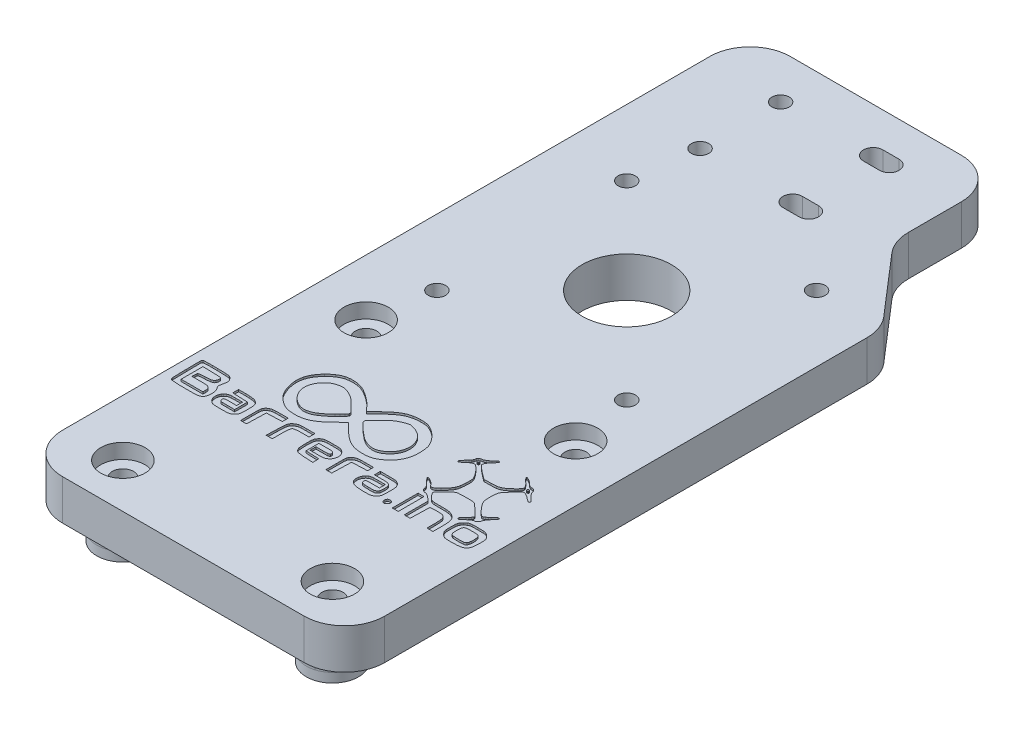
from build123d import *

# Parameters (mm, degrees)
SALIENTE_EXTRUIR1_DEPTH                              = 10
CROQUIS2_R                                           = 6.5
CROQUIS2_R_2                                         = 2.65
SALIENTE_EXTRUIR2_DEPTH                              = 7.3
CORTAR_EXTRUIR1_DEPTH                                = 46
CORTAR_EXTRUIR1_DEPTH_BACK                           = 68
CROQUIS3_R                                           = 2.65
CORTAR_EXTRUIR2_DEPTH                                = 37
CORTAR_EXTRUIR2_DEPTH_BACK                           = 32
CROQUIS4_R                                           = 2.15
CROQUIS4_R_2                                         = 11.1
CROQUIS6_R                                           = 2.15
CORTAR_EXTRUIR3_DEPTH                                = 28
REDONDEO4_R                                          = 5
REFRENTADO_PARA_TORNILLO_CON_CABEZA_TRON_D           = 5.3
REFRENTADO_PARA_TORNILLO_CON_CABEZA_TRON_CBORE_D     = 11
REFRENTADO_PARA_TORNILLO_CON_CABEZA_TRON_CBORE_DEPTH = 3.7
CORTAR_EXTRUIR4_DEPTH                                = 0.5


with BuildPart() as part:
    # Croquis1 → Saliente-Extruir1 (new body)
    with BuildSketch(Plane(origin=(0, 0, 0), x_dir=(1, 0, 0), z_dir=(0, 1, 0))):
        with BuildLine():
            ThreePointArc((22.488828135, 80.735340204), (19.559895947, 87.806408016), (12.488828135, 90.735340204))
            Line((12.488828135, 90.735340204), (-12.488828135, 90.735340204))
            Line((-12.488828135, 90.735340204), (-30, 90.735340204))
            ThreePointArc((-30, 90.735340204), (-37.071067812, 87.806408016), (-40, 80.735340204))
            Line((-40, 80.735340204), (-40, 39.832637169))
            Line((-40, 39.832637169), (-40, -80))
            ThreePointArc((-40, -80), (-37.071067812, -87.071067812), (-30, -90))
            Line((-30, -90), (30, -90))
            ThreePointArc((30, -90), (37.071067812, -87.071067812), (40, -80))
            Line((40, -80), (40, 39.832637169))
            ThreePointArc((40, 39.832637169), (39.373254076, 43.317189943), (37.571578393, 46.364956867))
            Line((37.571578393, 46.364956867), (24.917249742, 61.032524564))
            ThreePointArc((24.917249742, 61.032524564), (23.11557406, 64.080291488), (22.488828135, 67.564844262))
            Line((22.488828135, 67.564844262), (22.488828135, 80.735340204))
        make_face()
    extrude(amount=SALIENTE_EXTRUIR1_DEPTH)

    # Croquis2 → Saliente-Extruir2 (add)
    # profile 1 of 4: a face of its own
    with BuildSketch(Plane.XZ):
        with Locations(Location((-26.018819977, 79, 0), (0, 0, 90))):
            Circle(CROQUIS2_R)
        with Locations(Location((-26.018819977, 79, 0), (0, 0, 90))):
            Circle(CROQUIS2_R_2, mode=Mode.SUBTRACT)
    # profile 2 of 4: a face of its own
    with BuildSketch(Plane.XZ):
        with Locations(Location((-26.018819977, 18.6, 0), (0, 0, 90))):
            Circle(CROQUIS2_R)
        with Locations(Location((-26.018819977, 18.6, 0), (0, 0, 90))):
            Circle(CROQUIS2_R_2, mode=Mode.SUBTRACT)
    # profile 3 of 4: a face of its own
    with BuildSketch(Plane.XZ):
        with Locations(Location((26.018819977, 79, 0), (0, 0, 90))):
            Circle(CROQUIS2_R)
        with Locations(Location((26.018819977, 79, 0), (0, 0, 90))):
            Circle(CROQUIS2_R_2, mode=Mode.SUBTRACT)
    # profile 4 of 4: a face of its own
    with BuildSketch(Plane.XZ):
        with Locations(Location((26.018819977, 18.6, 0), (0, 0, 90))):
            Circle(CROQUIS2_R)
        with Locations(Location((26.018819977, 18.6, 0), (0, 0, 90))):
            Circle(CROQUIS2_R_2, mode=Mode.SUBTRACT)
    extrude(amount=SALIENTE_EXTRUIR2_DEPTH)

    # Croquis3 → Cortar-Extruir1 (cut, two sides: drawn at the far end of the back side and taken through both)
    with BuildSketch(Plane.XZ.offset(-CORTAR_EXTRUIR1_DEPTH_BACK)):
        with Locations(Location((-26.018819977, 79, 0), (0, 0, 90))):
            Circle(CROQUIS3_R)
        with Locations(Location((-26.018819977, 18.6, 0), (0, 0, 90))):
            Circle(CROQUIS3_R)
        with Locations(Location((26.018819977, 18.6, 0), (0, 0, 90))):
            Circle(CROQUIS3_R)
        with Locations(Location((26.018819977, 79, 0), (0, 0, 90))):
            Circle(CROQUIS3_R)
    extrude(amount=CORTAR_EXTRUIR1_DEPTH + CORTAR_EXTRUIR1_DEPTH_BACK, mode=Mode.SUBTRACT)

    # Croquis4 → Cortar-Extruir2 (cut, two sides: drawn at the far end of the back side and taken through both)
    with BuildSketch(Plane.XZ.offset(-CORTAR_EXTRUIR2_DEPTH_BACK)):
        with Locations(Location((-23.57, -43.677581212, 0), (0, 0, 90))):
            Circle(CROQUIS4_R)
        with Locations(Location((-23.57, 3.462418788, 0), (0, 0, 90))):
            Circle(CROQUIS4_R)
        with Locations(Location((23.57, 3.462418788, 0), (0, 0, 90))):
            Circle(CROQUIS4_R)
        with Locations(Location((23.57, -43.677581212, 0), (0, 0, 90))):
            Circle(CROQUIS4_R)
        with Locations(Location((0, -20.107581212, 0), (0, 0, 90))):
            Circle(CROQUIS4_R_2)
    extrude(amount=CORTAR_EXTRUIR2_DEPTH + CORTAR_EXTRUIR2_DEPTH_BACK, mode=Mode.SUBTRACT)

    # Croquis6 → Cortar-Extruir3 (cut)
    with BuildSketch(Plane(origin=(0, 10, 0), x_dir=(1, 0, 0), z_dir=(0, 1, 0))):
        with Locations(Location((-21.42, 59.735340204, 0), (0, 0, 270))):
            Circle(CROQUIS6_R)
        with Locations(Location((-21.42, 79.735340204, 0), (0, 0, 270))):
            Circle(CROQUIS6_R)
        with BuildLine():
            Line((1.58, 82.148664325), (5.58, 82.148664325))
            ThreePointArc((5.58, 82.148664325), (7.993324121, 79.735340204), (5.58, 77.322016083))
            Line((5.58, 77.322016083), (1.58, 77.322016083))
            ThreePointArc((1.58, 77.322016083), (-0.833324121, 79.735340204), (1.58, 82.148664325))
        make_face()
        with BuildLine():
            Line((1.58, 57.322016083), (5.58, 57.322016083))
            ThreePointArc((5.58, 57.322016083), (7.993324121, 59.735340204), (5.58, 62.148664325))
            Line((5.58, 62.148664325), (1.58, 62.148664325))
            ThreePointArc((1.58, 62.148664325), (-0.833324121, 59.735340204), (1.58, 57.322016083))
        make_face()
    extrude(amount=-CORTAR_EXTRUIR3_DEPTH, mode=Mode.SUBTRACT)

    # Redondeo4
    redondeo4_edges = [part.edges().sort_by_distance(p)[0] for p in [
        (-26.018819977, 0, 72.5),
        (-26.018819977, 0, 12.1),
        (26.018819977, 0, 72.5),
        (26.018819977, 0, 12.1),
    ]]
    fillet(redondeo4_edges, radius=REDONDEO4_R)

    # Refrentado para tornillo con cabeza troncocónica de M52 (through all)
    with Locations(Plane(origin=(26.018819977, 10, 18.6), x_dir=(0, 0, 1), z_dir=(0, 1, 0))):
        with Locations((0, 0), (60.4, 0), (60.4, -52.037639954), (0, -52.037639954)):
            CounterBoreHole(REFRENTADO_PARA_TORNILLO_CON_CABEZA_TRON_D / 2, REFRENTADO_PARA_TORNILLO_CON_CABEZA_TRON_CBORE_D / 2, REFRENTADO_PARA_TORNILLO_CON_CABEZA_TRON_CBORE_DEPTH)

    # Croquis11 → Cortar-Extruir4 (cut)
    # profile 1 of 12: a face of its own
    with BuildSketch(Plane(origin=(0, 10, 0), x_dir=(1, 0, 0), z_dir=(0, 1, 0))):
        with BuildLine():
            Line((21.205867593, -36.974755578), (22.878522996, -38.250077323))
            Line((22.878522996, -38.250077323), (24.66930308, -38.222125797))
            ThreePointArc((24.66930308, -38.222125797), (25.307201331, -38.195578118), (25.942859138, -38.13592822))
            ThreePointArc((25.942859138, -38.13592822), (26.381729162, -38.050484265), (26.803578208, -37.902325736))
            ThreePointArc((26.803578208, -37.902325736), (27.22801271, -37.684270925), (27.621085456, -37.413741142))
            ThreePointArc((27.621085456, -37.413741142), (28.212440327, -36.931759289), (28.787114989, -36.430006239))
            ThreePointArc((28.787114989, -36.430006239), (28.976211113, -36.250630438), (29.156365131, -36.06227558))
            ThreePointArc((29.156365131, -36.06227558), (29.317825518, -35.87460743), (29.468386089, -35.678086933))
            ThreePointArc((29.468386089, -35.678086933), (29.584644967, -35.506751565), (29.6907051, -35.328922481))
            ThreePointArc((29.6907051, -35.328922481), (29.736236873, -35.215398393), (29.751746657, -35.09407112))
            ThreePointArc((29.751746657, -35.09407112), (29.736000515, -34.972197106), (29.68979602, -34.858327177))
            ThreePointArc((29.68979602, -34.858327177), (29.581189572, -34.678234542), (29.46242684, -34.504671496))
            ThreePointArc((29.46242684, -34.504671496), (29.308601666, -34.305151426), (29.143851987, -34.114552408))
            ThreePointArc((29.143851987, -34.114552408), (28.959805323, -33.922687848), (28.766828129, -33.739808144))
            ThreePointArc((28.766828129, -33.739808144), (28.576101225, -33.563422644), (28.389531695, -33.382645414))
            ThreePointArc((28.389531695, -33.382645414), (28.227624077, -33.21672872), (28.071229419, -33.045605556))
            ThreePointArc((28.071229419, -33.045605556), (27.9473345, -32.901901964), (27.82709791, -32.75512378))
            ThreePointArc((27.82709791, -32.75512378), (27.793533327, -32.694450147), (27.781909601, -32.626092559))
            ThreePointArc((27.781909601, -32.626092559), (27.829463956, -32.534969606), (27.931410631, -32.521866756))
            ThreePointArc((27.931410631, -32.521866756), (28.211735222, -32.636994619), (28.482909112, -32.77227589))
            ThreePointArc((28.482909112, -32.77227589), (28.805608799, -32.962981619), (29.114400707, -33.175470018))
            ThreePointArc((29.114400707, -33.175470018), (29.371141928, -33.385948788), (29.605818173, -33.620777293))
            ThreePointArc((29.605818173, -33.620777293), (29.710072069, -33.725188139), (29.824056913, -33.818878881))
            ThreePointArc((29.824056913, -33.818878881), (29.954596326, -33.907982963), (30.091833115, -33.986380281))
            ThreePointArc((30.091833115, -33.986380281), (30.22664915, -34.049453092), (30.366226, -34.101142988))
            ThreePointArc((30.366226, -34.101142988), (30.482883115, -34.129062236), (30.602467081, -34.1384453))
            ThreePointArc((30.602467081, -34.1384453), (30.817936072, -34.156648365), (31.027297407, -34.210741521))
            ThreePointArc((31.027297407, -34.210741521), (31.218585426, -34.298159712), (31.39076263, -34.41894074))
            ThreePointArc((31.39076263, -34.41894074), (31.528234298, -34.561104572), (31.635082751, -34.727514976))
            ThreePointArc((31.635082751, -34.727514976), (31.699654816, -34.902290664), (31.721583713, -35.087318272))
            ThreePointArc((31.721583713, -35.087318272), (31.73646006, -35.188659465), (31.779833765, -35.2814499))
            ThreePointArc((31.779833765, -35.2814499), (31.900909728, -35.457211052), (32.028986143, -35.627938329))
            ThreePointArc((32.028986143, -35.627938329), (32.193853304, -35.829505405), (32.367333235, -36.023709372))
            ThreePointArc((32.367333235, -36.023709372), (32.564314216, -36.227787666), (32.768059649, -36.425112918))
            ThreePointArc((32.768059649, -36.425112918), (33.155949295, -36.806532341), (33.524734389, -37.206453218))
            ThreePointArc((33.524734389, -37.206453218), (33.578683943, -37.370932745), (33.49720173, -37.523657064))
            ThreePointArc((33.49720173, -37.523657064), (33.312003569, -37.593598523), (33.121265468, -37.540597171))
            ThreePointArc((33.121265468, -37.540597171), (32.658281938, -37.217309075), (32.210282805, -36.873556665))
            ThreePointArc((32.210282805, -36.873556665), (32.01374042, -36.722662767), (31.810698403, -36.580635247))
            ThreePointArc((31.810698403, -36.580635247), (31.607148972, -36.451868858), (31.39761914, -36.333081638))
            ThreePointArc((31.39761914, -36.333081638), (31.214101171, -36.2405484), (31.026259303, -36.157141702))
            ThreePointArc((31.026259303, -36.157141702), (30.90604654, -36.120616045), (30.781014097, -36.108282356))
            ThreePointArc((30.781014097, -36.108282356), (30.572427557, -36.145510307), (30.389597871, -36.252597051))
            ThreePointArc((30.389597871, -36.252597051), (30.040999977, -36.563333061), (29.706125231, -36.888811576))
            ThreePointArc((29.706125231, -36.888811576), (29.269828917, -37.350018826), (28.852717457, -37.82864669))
            ThreePointArc((28.852717457, -37.82864669), (28.32716685, -38.469220348), (27.8136715, -39.119497656))
            ThreePointArc((27.8136715, -39.119497656), (27.730370583, -39.252678782), (27.675225935, -39.399768288))
            ThreePointArc((27.675225935, -39.399768288), (27.617357149, -39.644575299), (27.572508535, -39.892098774))
            ThreePointArc((27.572508535, -39.892098774), (27.531690931, -40.205931779), (27.505644632, -40.521334413))
            ThreePointArc((27.505644632, -40.521334413), (27.489293918, -40.891083731), (27.48384223, -41.261154242))
            ThreePointArc((27.48384223, -41.261154242), (27.490162481, -41.717581914), (27.509118194, -42.17365959))
            ThreePointArc((27.509118194, -42.17365959), (27.539240955, -42.487341035), (27.594552982, -42.797573221))
            ThreePointArc((27.594552982, -42.797573221), (27.664881147, -43.051744514), (27.761781314, -43.297018758))
            ThreePointArc((27.761781314, -43.297018758), (27.890753424, -43.549538074), (28.040843944, -43.790105416))
            ThreePointArc((28.040843944, -43.790105416), (28.381990106, -44.26313032), (28.745624311, -44.719094606))
            ThreePointArc((28.745624311, -44.719094606), (29.138798405, -45.167311805), (29.551868276, -45.59726274))
            ThreePointArc((29.551868276, -45.59726274), (29.92584669, -45.955985704), (30.312623041, -46.3008713))
            ThreePointArc((30.312623041, -46.3008713), (30.500290659, -46.411463799), (30.714697809, -46.4499269))
            ThreePointArc((30.714697809, -46.4499269), (30.816924878, -46.436620152), (30.912338947, -46.397586852))
            ThreePointArc((30.912338947, -46.397586852), (31.080536468, -46.296758266), (31.244079206, -46.188542819))
            ThreePointArc((31.244079206, -46.188542819), (31.435569592, -46.048988234), (31.620450555, -45.900788776))
            ThreePointArc((31.620450555, -45.900788776), (31.811663224, -45.733966121), (31.996502791, -45.560108658))
            ThreePointArc((31.996502791, -45.560108658), (32.413912184, -45.169626842), (32.847658549, -44.797375931))
            ThreePointArc((32.847658549, -44.797375931), (33.030903017, -44.725422788), (33.221492501, -44.774732408))
            ThreePointArc((33.221492501, -44.774732408), (33.316116997, -44.915261741), (33.27747921, -45.080214492))
            ThreePointArc((33.27747921, -45.080214492), (32.937875292, -45.513519351), (32.578439687, -45.930520511))
            ThreePointArc((32.578439687, -45.930520511), (32.390737434, -46.146630895), (32.211625741, -46.369912858))
            ThreePointArc((32.211625741, -46.369912858), (32.048800811, -46.591176005), (31.895916755, -46.819421056))
            ThreePointArc((31.895916755, -46.819421056), (31.775375011, -47.017781787), (31.663683308, -47.221257227))
            ThreePointArc((31.663683308, -47.221257227), (31.614129819, -47.345908874), (31.590754769, -47.477996679))
            ThreePointArc((31.590754769, -47.477996679), (31.558159245, -47.663429574), (31.489211146, -47.838626567))
            ThreePointArc((31.489211146, -47.838626567), (31.38540054, -48.000813579), (31.253116326, -48.140749834))
            ThreePointArc((31.253116326, -48.140749834), (31.093060732, -48.257140398), (30.914617803, -48.342713041))
            ThreePointArc((30.914617803, -48.342713041), (30.720618793, -48.396414317), (30.520278831, -48.415993442))
            ThreePointArc((30.520278831, -48.415993442), (30.423049005, -48.429630656), (30.3324593, -48.467487198))
            ThreePointArc((30.3324593, -48.467487198), (30.157575785, -48.572770861), (29.986556651, -48.684221968))
            ThreePointArc((29.986556651, -48.684221968), (29.784485427, -48.826916953), (29.58811968, -48.977366716))
            ThreePointArc((29.58811968, -48.977366716), (29.381446503, -49.147455801), (29.180098959, -49.323816979))
            ThreePointArc((29.180098959, -49.323816979), (28.78055634, -49.666619843), (28.363994481, -49.988527167))
            ThreePointArc((28.363994481, -49.988527167), (28.203705814, -50.020784826), (28.075432805, -49.919399183))
            ThreePointArc((28.075432805, -49.919399183), (28.038676209, -49.717612782), (28.117772729, -49.528370769))
            ThreePointArc((28.117772729, -49.528370769), (28.48051577, -49.10319459), (28.861928415, -48.694683034))
            ThreePointArc((28.861928415, -48.694683034), (29.034858517, -48.512641054), (29.202713181, -48.325908853))
            ThreePointArc((29.202713181, -48.325908853), (29.349781097, -48.15135507), (29.490362576, -47.971536152))
            ThreePointArc((29.490362576, -47.971536152), (29.600534892, -47.820268062), (29.705886634, -47.66560396))
            ThreePointArc((29.705886634, -47.66560396), (29.740035294, -47.592435031), (29.751746657, -47.512543435))
            ThreePointArc((29.751746657, -47.512543435), (29.714847353, -47.328747164), (29.609867912, -47.173434754))
            ThreePointArc((29.609867912, -47.173434754), (28.948592305, -46.527040249), (28.281828392, -45.886308504))
            ThreePointArc((28.281828392, -45.886308504), (27.618027101, -45.260268609), (26.947879853, -44.641026516))
            ThreePointArc((26.947879853, -44.641026516), (26.757012657, -44.513622665), (26.536726352, -44.44931114))
            ThreePointArc((26.536726352, -44.44931114), (26.031989435, -44.396916224), (25.525094371, -44.373210179))
            ThreePointArc((25.525094371, -44.373210179), (24.82221691, -44.368013654), (24.11939501, -44.378265766))
            ThreePointArc((24.11939501, -44.378265766), (23.427637138, -44.400948662), (22.736277861, -44.433595534))
            ThreePointArc((22.736277861, -44.433595534), (22.490321944, -44.472013155), (22.256997299, -44.558787789))
            ThreePointArc((22.256997299, -44.558787789), (21.882524355, -44.773772414), (21.538843216, -45.035175645))
            ThreePointArc((21.538843216, -45.035175645), (21.026706251, -45.495332367), (20.530691199, -45.972823255))
            ThreePointArc((20.530691199, -45.972823255), (20.047254918, -46.465770787), (19.575359377, -46.969777241))
            ThreePointArc((19.575359377, -46.969777241), (19.452867023, -47.167035745), (19.410102113, -47.395260321))
            ThreePointArc((19.410102113, -47.395260321), (19.422473787, -47.498036768), (19.458881681, -47.594941473))
            ThreePointArc((19.458881681, -47.594941473), (19.546104463, -47.752814829), (19.641280713, -47.906024789))
            ThreePointArc((19.641280713, -47.906024789), (19.764147173, -48.083026444), (19.895828474, -48.253572005))
            ThreePointArc((19.895828474, -48.253572005), (20.04277569, -48.426416507), (20.197093137, -48.592713926))
            ThreePointArc((20.197093137, -48.592713926), (20.460531421, -48.846685078), (20.740577091, -49.082217449))
            ThreePointArc((20.740577091, -49.082217449), (20.950740862, -49.214671973), (21.183554048, -49.301338184))
            ThreePointArc((21.183554048, -49.301338184), (21.492724933, -49.362627611), (21.806894703, -49.387933452))
            ThreePointArc((21.806894703, -49.387933452), (22.571658526, -49.401035828), (23.336520945, -49.40560289))
            ThreePointArc((23.336520945, -49.40560289), (23.965426417, -49.411068736), (24.59415455, -49.426971683))
            ThreePointArc((24.59415455, -49.426971683), (24.992364791, -49.452437195), (25.388304208, -49.50195353))
            ThreePointArc((25.388304208, -49.50195353), (25.683540191, -49.562117234), (25.97194132, -49.649345357))
            ThreePointArc((25.97194132, -49.649345357), (26.240100443, -49.760174227), (26.495341553, -49.89817542))
            ThreePointArc((26.495341553, -49.89817542), (26.84247819, -50.147486286), (27.14827507, -50.446062944))
            ThreePointArc((27.14827507, -50.446062944), (27.375127707, -50.762141199), (27.535003823, -51.116834321))
            ThreePointArc((27.535003823, -51.116834321), (27.663586253, -51.601546897), (27.7285967, -52.098792676))
            ThreePointArc((27.7285967, -52.098792676), (27.768577913, -52.913826068), (27.781909601, -53.729730593))
            Line((27.781909601, -53.729730593), (27.781909601, -55.806652916))
            Line((27.781909601, -55.806652916), (27.043220705, -55.806652916))
            Line((27.043220705, -55.806652916), (26.304531809, -55.806652916))
            Line((26.304531809, -55.806652916), (26.304531809, -53.83682351))
            ThreePointArc((26.304531809, -53.83682351), (26.281681092, -53.003437447), (26.213197606, -52.172555687))
            ThreePointArc((26.213197606, -52.172555687), (26.097746473, -51.741408994), (25.8585378, -51.364585898))
            ThreePointArc((25.8585378, -51.364585898), (25.536901939, -51.109205204), (25.145391781, -50.985153914))
            ThreePointArc((25.145391781, -50.985153914), (24.45845297, -50.928968985), (23.769227709, -50.932165459))
            Line((23.769227709, -50.932165459), (22.241742881, -51.005175092))
            Line((22.241742881, -51.005175092), (22.171269006, -53.405914004))
            Line((22.171269006, -53.405914004), (22.10079513, -55.806652916))
            Line((22.10079513, -55.806652916), (21.371022702, -55.806652916))
            Line((21.371022702, -55.806652916), (20.641250273, -55.806652916))
            Line((20.641250273, -55.806652916), (20.641250273, -52.848426479))
            Line((20.641250273, -52.848426479), (20.641250273, -49.890199796))
            Line((20.641250273, -49.890199796), (19.841003918, -49.162199682))
            ThreePointArc((19.841003918, -49.162199682), (19.673163006, -49.017842022), (19.497548843, -48.88304821))
            ThreePointArc((19.497548843, -48.88304821), (19.31592365, -48.759226508), (19.12755361, -48.64592932))
            ThreePointArc((19.12755361, -48.64592932), (18.958276164, -48.557067344), (18.784029787, -48.47839394))
            ThreePointArc((18.784029787, -48.47839394), (18.662458841, -48.440865221), (18.53598692, -48.426981685))
            ThreePointArc((18.53598692, -48.426981685), (18.318785008, -48.404866959), (18.108711534, -48.34541221))
            ThreePointArc((18.108711534, -48.34541221), (17.920868736, -48.252075382), (17.754845819, -48.123883842))
            ThreePointArc((17.754845819, -48.123883842), (17.621561575, -47.969779883), (17.522268389, -47.791865344))
            ThreePointArc((17.522268389, -47.791865344), (17.460979689, -47.597365846), (17.440265057, -47.394493316))
            ThreePointArc((17.440265057, -47.394493316), (17.424294351, -47.276675958), (17.377534857, -47.167361993))
            ThreePointArc((17.377534857, -47.167361993), (17.259953017, -46.98136105), (17.133295746, -46.801417237))
            ThreePointArc((17.133295746, -46.801417237), (16.969468218, -46.59170066), (16.795344345, -46.390451117))
            ThreePointArc((16.795344345, -46.390451117), (16.599448317, -46.183835014), (16.395263052, -45.985406574))
            ThreePointArc((16.395263052, -45.985406574), (16.198028871, -45.795499418), (16.006907214, -45.599441872))
            ThreePointArc((16.006907214, -45.599441872), (15.852471638, -45.42711736), (15.707240581, -45.246967355))
            ThreePointArc((15.707240581, -45.246967355), (15.603634168, -45.10431194), (15.507062785, -44.956803216))
            ThreePointArc((15.507062785, -44.956803216), (15.493509508, -44.89625605), (15.520507907, -44.840392494))
            ThreePointArc((15.520507907, -44.840392494), (15.655525269, -44.771142093), (15.805583711, -44.793675838))
            ThreePointArc((15.805583711, -44.793675838), (16.17823008, -44.989587412), (16.541267867, -45.202778))
            ThreePointArc((16.541267867, -45.202778), (16.899293371, -45.438777869), (17.243381567, -45.694671428))
            ThreePointArc((17.243381567, -45.694671428), (17.413679231, -45.870694357), (17.531220313, -46.085565155))
            ThreePointArc((17.531220313, -46.085565155), (17.641521161, -46.258890961), (17.81068873, -46.375469029))
            ThreePointArc((17.81068873, -46.375469029), (18.021738809, -46.425159946), (18.237191201, -46.40083733))
            ThreePointArc((18.237191201, -46.40083733), (18.532317764, -46.283378465), (18.800108335, -46.112543797))
            ThreePointArc((18.800108335, -46.112543797), (19.13342703, -45.831721909), (19.444621538, -45.52656578))
            ThreePointArc((19.444621538, -45.52656578), (19.985049337, -44.933726592), (20.503454015, -44.321536182))
            ThreePointArc((20.503454015, -44.321536182), (20.810281008, -43.89465299), (21.062735077, -43.433525019))
            ThreePointArc((21.062735077, -43.433525019), (21.237671981, -42.981077081), (21.347002016, -42.508468362))
            ThreePointArc((21.347002016, -42.508468362), (21.428315822, -41.866558119), (21.470310615, -41.2208824))
            ThreePointArc((21.470310615, -41.2208824), (21.481992188, -40.711697142), (21.481976236, -40.202377904))
            ThreePointArc((21.481976236, -40.202377904), (21.463778216, -39.89592965), (21.416412918, -39.592617552))
            ThreePointArc((21.416412918, -39.592617552), (21.348209257, -39.344967178), (21.24798791, -39.108454749))
            ThreePointArc((21.24798791, -39.108454749), (21.096628088, -38.833620277), (20.925593297, -38.570578676))
            ThreePointArc((20.925593297, -38.570578676), (20.557857395, -38.068620814), (20.171139057, -37.581137156))
            ThreePointArc((20.171139057, -37.581137156), (19.817239512, -37.177284931), (19.439951793, -36.795191377))
            ThreePointArc((19.439951793, -36.795191377), (19.125622812, -36.514329694), (18.793585466, -36.254642973))
            ThreePointArc((18.793585466, -36.254642973), (18.581016969, -36.1457984), (18.345167327, -36.108282356))
            ThreePointArc((18.345167327, -36.108282356), (18.218611318, -36.122567558), (18.09842406, -36.164704399))
            ThreePointArc((18.09842406, -36.164704399), (17.904169603, -36.264494034), (17.715133904, -36.373847909))
            ThreePointArc((17.715133904, -36.373847909), (17.497271146, -36.514760578), (17.286639681, -36.666269481))
            ThreePointArc((17.286639681, -36.666269481), (17.073889451, -36.834785908), (16.868617359, -37.012335379))
            ThreePointArc((16.868617359, -37.012335379), (16.46907474, -37.355138243), (16.052512881, -37.677045567))
            ThreePointArc((16.052512881, -37.677045567), (15.892224214, -37.709303226), (15.763951205, -37.607917583))
            ThreePointArc((15.763951205, -37.607917583), (15.727194609, -37.406131182), (15.806291129, -37.216889169))
            ThreePointArc((15.806291129, -37.216889169), (16.16903417, -36.79171299), (16.550446815, -36.383201434))
            ThreePointArc((16.550446815, -36.383201434), (16.7243113, -36.198341402), (16.89112644, -36.007096012))
            ThreePointArc((16.89112644, -36.007096012), (17.039333819, -35.82213949), (17.178880976, -35.630564614))
            ThreePointArc((17.178880976, -35.630564614), (17.287087182, -35.466926602), (17.387887829, -35.298625648))
            ThreePointArc((17.387887829, -35.298625648), (17.426949264, -35.203054146), (17.440265057, -35.100670567))
            ThreePointArc((17.440265057, -35.100670567), (17.461373807, -34.916042663), (17.523610833, -34.740943848))
            ThreePointArc((17.523610833, -34.740943848), (17.626867815, -34.572764289), (17.760109962, -34.427186478))
            ThreePointArc((17.760109962, -34.427186478), (17.924015275, -34.304302327), (18.107456747, -34.213117391))
            ThreePointArc((18.107456747, -34.213117391), (18.303333916, -34.1572743), (18.506143642, -34.1384453))
            ThreePointArc((18.506143642, -34.1384453), (18.631190126, -34.124656593), (18.750227875, -34.083953205))
            ThreePointArc((18.750227875, -34.083953205), (18.938569729, -33.989426659), (19.12177337, -33.88529046))
            ThreePointArc((19.12177337, -33.88529046), (19.331895091, -33.751157654), (19.534929949, -33.606521582))
            ThreePointArc((19.534929949, -33.606521582), (19.738682262, -33.446098805), (19.934984895, -33.276641588))
            ThreePointArc((19.934984895, -33.276641588), (20.267314907, -32.97999492), (20.603171846, -32.68734735))
            ThreePointArc((20.603171846, -32.68734735), (20.752203923, -32.573629207), (20.913582216, -32.478238313))
            ThreePointArc((20.913582216, -32.478238313), (20.990920847, -32.464862702), (21.062065332, -32.498008336))
            ThreePointArc((21.062065332, -32.498008336), (21.115002268, -32.571630532), (21.133709537, -32.660358121))
            ThreePointArc((21.133709537, -32.660358121), (21.122892267, -32.735132927), (21.091327432, -32.803776544))
            ThreePointArc((21.091327432, -32.803776544), (20.985017514, -32.963479963), (20.874704281, -33.120444836))
            ThreePointArc((20.874704281, -33.120444836), (20.735119807, -33.307529406), (20.589707024, -33.490120709))
            ThreePointArc((20.589707024, -33.490120709), (20.423120901, -33.687938584), (20.251989295, -33.881837582))
            ThreePointArc((20.251989295, -33.881837582), (20.08133956, -34.080107059), (19.920416719, -34.286349531))
            ThreePointArc((19.920416719, -34.286349531), (19.780772651, -34.486585424), (19.653207091, -34.694724576))
            ThreePointArc((19.653207091, -34.694724576), (19.55862869, -34.872108246), (19.475014154, -35.05491593))
            ThreePointArc((19.475014154, -35.05491593), (19.446765764, -35.165038158), (19.451742991, -35.278616782))
            ThreePointArc((19.451742991, -35.278616782), (19.493754207, -35.401281825), (19.567757283, -35.507748721))
            ThreePointArc((19.567757283, -35.507748721), (19.781089104, -35.732131129), (20.000625775, -35.950446453))
            ThreePointArc((20.000625775, -35.950446453), (20.275741827, -36.207700119), (20.559312685, -36.455603041))
            ThreePointArc((20.559312685, -36.455603041), (20.879330391, -36.719239014), (21.205867593, -36.974755578))
        make_face()
        with BuildLine():
            ThreePointArc((18.178953953, -35.123363828), (18.183701286, -35.171288953), (18.197758736, -35.217351333))
            ThreePointArc((18.197758736, -35.217351333), (18.220608403, -35.259927826), (18.251283449, -35.297262884))
            ThreePointArc((18.251283449, -35.297262884), (18.288618697, -35.327938208), (18.331195459, -35.350788056))
            ThreePointArc((18.331195459, -35.350788056), (18.377257839, -35.364845505), (18.425182964, -35.369592839))
            ThreePointArc((18.425182964, -35.369592839), (18.473108172, -35.364845521), (18.519170632, -35.350788056))
            ThreePointArc((18.519170632, -35.350788056), (18.561747124, -35.327938389), (18.599082183, -35.297263343))
            ThreePointArc((18.599082183, -35.297263343), (18.629757507, -35.259928095), (18.652607354, -35.217351333))
            ThreePointArc((18.652607354, -35.217351333), (18.666664804, -35.171288953), (18.671412137, -35.123363828))
            ThreePointArc((18.671412137, -35.123363828), (18.66666482, -35.07543862), (18.652607354, -35.02937616))
            ThreePointArc((18.652607354, -35.02937616), (18.629757687, -34.986799668), (18.599082641, -34.949464609))
            ThreePointArc((18.599082641, -34.949464609), (18.561747394, -34.918789285), (18.519170632, -34.895939438))
            ThreePointArc((18.519170632, -34.895939438), (18.473108251, -34.881881988), (18.425183127, -34.877134655))
            ThreePointArc((18.425183127, -34.877134655), (18.377257919, -34.881881972), (18.331195459, -34.895939438))
            ThreePointArc((18.331195459, -34.895939438), (18.288618966, -34.918789105), (18.251283908, -34.94946415))
            ThreePointArc((18.251283908, -34.94946415), (18.220608584, -34.986799398), (18.197758736, -35.02937616))
            ThreePointArc((18.197758736, -35.02937616), (18.18370127, -35.07543862), (18.178953953, -35.123363828))
        make_face(mode=Mode.SUBTRACT)
        with BuildLine():
            ThreePointArc((30.490435553, -35.123363828), (30.495182886, -35.171288953), (30.509240336, -35.217351333))
            ThreePointArc((30.509240336, -35.217351333), (30.532090003, -35.259927826), (30.562765049, -35.297262884))
            ThreePointArc((30.562765049, -35.297262884), (30.600100297, -35.327938208), (30.642677059, -35.350788056))
            ThreePointArc((30.642677059, -35.350788056), (30.688739439, -35.364845505), (30.736664564, -35.369592839))
            ThreePointArc((30.736664564, -35.369592839), (30.784589772, -35.364845521), (30.830652232, -35.350788056))
            ThreePointArc((30.830652232, -35.350788056), (30.873228724, -35.327938389), (30.910563783, -35.297263343))
            ThreePointArc((30.910563783, -35.297263343), (30.941239107, -35.259928095), (30.964088954, -35.217351333))
            ThreePointArc((30.964088954, -35.217351333), (30.978146404, -35.171288953), (30.982893737, -35.123363828))
            ThreePointArc((30.982893737, -35.123363828), (30.97814642, -35.07543862), (30.964088954, -35.02937616))
            ThreePointArc((30.964088954, -35.02937616), (30.941239287, -34.986799668), (30.910564241, -34.949464609))
            ThreePointArc((30.910564241, -34.949464609), (30.873228994, -34.918789285), (30.830652232, -34.895939438))
            ThreePointArc((30.830652232, -34.895939438), (30.784589851, -34.881881988), (30.736664727, -34.877134655))
            ThreePointArc((30.736664727, -34.877134655), (30.688739519, -34.881881972), (30.642677059, -34.895939438))
            ThreePointArc((30.642677059, -34.895939438), (30.600100566, -34.918789105), (30.562765508, -34.94946415))
            ThreePointArc((30.562765508, -34.94946415), (30.532090184, -34.986799398), (30.509240336, -35.02937616))
            ThreePointArc((30.509240336, -35.02937616), (30.49518287, -35.07543862), (30.490435553, -35.123363828))
        make_face(mode=Mode.SUBTRACT)
    # profile 2 of 12: a face of its own
    with BuildSketch(Plane(origin=(0, 10, 0), x_dir=(1, 0, 0), z_dir=(0, 1, 0))):
        with BuildLine():
            Line((-7.25442188, -37.193273285), (-6.287578823, -38.291665015))
            Line((-6.287578823, -38.291665015), (-4.450388796, -36.522842362))
            ThreePointArc((-4.450388796, -36.522842362), (-3.577606293, -35.724080071), (-2.665545861, -34.97047788))
            ThreePointArc((-2.665545861, -34.97047788), (-1.910411665, -34.439572436), (-1.103814475, -33.990696933))
            ThreePointArc((-1.103814475, -33.990696933), (-0.34561025, -33.676080274), (0.445693825, -33.457688081))
            ThreePointArc((0.445693825, -33.457688081), (1.305199824, -33.323282659), (2.174027873, -33.279087633))
            ThreePointArc((2.174027873, -33.279087633), (2.698212758, -33.287205072), (3.221957549, -33.31016329))
            ThreePointArc((3.221957549, -33.31016329), (3.578012505, -33.346069142), (3.929728867, -33.412099157))
            ThreePointArc((3.929728867, -33.412099157), (4.25289548, -33.503518515), (4.565916061, -33.6252242))
            ThreePointArc((4.565916061, -33.6252242), (4.965115911, -33.813051673), (5.355919459, -34.017776529))
            ThreePointArc((5.355919459, -34.017776529), (5.915252722, -34.363583466), (6.43743264, -34.763288695))
            ThreePointArc((6.43743264, -34.763288695), (6.973577979, -35.252989514), (7.472006821, -35.781030617))
            ThreePointArc((7.472006821, -35.781030617), (7.919782462, -36.332557198), (8.324890372, -36.916142819))
            ThreePointArc((8.324890372, -36.916142819), (8.623113208, -37.448910734), (8.856625232, -38.013047815))
            ThreePointArc((8.856625232, -38.013047815), (8.927843521, -38.247472558), (8.980774459, -38.486690703))
            ThreePointArc((8.980774459, -38.486690703), (9.037929394, -38.829593734), (9.085457017, -39.173963158))
            ThreePointArc((9.085457017, -39.173963158), (9.127213371, -39.554308303), (9.158462872, -39.93566049))
            ThreePointArc((9.158462872, -39.93566049), (9.177385415, -40.299385984), (9.18466786, -40.663530548))
            ThreePointArc((9.18466786, -40.663530548), (9.120895122, -41.689992844), (8.922468759, -42.69911067))
            ThreePointArc((8.922468759, -42.69911067), (8.598290898, -43.629459253), (8.138584907, -44.500843309))
            ThreePointArc((8.138584907, -44.500843309), (7.544332054, -45.309264851), (6.838288571, -46.022135417))
            ThreePointArc((6.838288571, -46.022135417), (5.985288961, -46.680871156), (5.060379881, -47.234120017))
            ThreePointArc((5.060379881, -47.234120017), (4.764791656, -47.375136901), (4.460143444, -47.495335184))
            ThreePointArc((4.460143444, -47.495335184), (4.15714938, -47.590082208), (3.847827721, -47.661514086))
            ThreePointArc((3.847827721, -47.661514086), (3.488039018, -47.718642248), (3.125372498, -47.753059308))
            ThreePointArc((3.125372498, -47.753059308), (2.649935688, -47.776305879), (2.174027873, -47.785913974))
            ThreePointArc((2.174027873, -47.785913974), (1.299481113, -47.745591855), (0.433826296, -47.614826239))
            ThreePointArc((0.433826296, -47.614826239), (-0.358688617, -47.399981537), (-1.117998287, -47.087432407))
            ThreePointArc((-1.117998287, -47.087432407), (-1.918041441, -46.642813054), (-2.665624654, -46.114727115))
            ThreePointArc((-2.665624654, -46.114727115), (-3.558295841, -45.369650761), (-4.410023462, -44.578094901))
            Line((-4.410023462, -44.578094901), (-6.193931538, -42.829377964))
            Line((-6.193931538, -42.829377964), (-7.995597608, -44.578089081))
            ThreePointArc((-7.995597608, -44.578089081), (-8.852980175, -45.368126411), (-9.750181299, -46.112635641))
            ThreePointArc((-9.750181299, -46.112635641), (-10.497985363, -46.639477148), (-11.297299449, -47.084302829))
            ThreePointArc((-11.297299449, -47.084302829), (-12.052940585, -47.397360088), (-12.841541636, -47.614401))
            ThreePointArc((-12.841541636, -47.614401), (-13.700939444, -47.748505452), (-14.569587103, -47.793225024))
            ThreePointArc((-14.569587103, -47.793225024), (-15.271999484, -47.768394573), (-15.97094125, -47.694366782))
            ThreePointArc((-15.97094125, -47.694366782), (-16.555238006, -47.577211977), (-17.122317165, -47.39404764))
            ThreePointArc((-17.122317165, -47.39404764), (-17.673889672, -47.144006619), (-18.194104522, -46.833959438))
            ThreePointArc((-18.194104522, -46.833959438), (-18.78845193, -46.404981452), (-19.354348643, -45.939114664))
            ThreePointArc((-19.354348643, -45.939114664), (-19.991695064, -45.276635004), (-20.50899301, -44.516705668))
            ThreePointArc((-20.50899301, -44.516705668), (-20.97064346, -43.576287875), (-21.322065662, -42.589368831))
            ThreePointArc((-21.322065662, -42.589368831), (-21.560496519, -41.562337389), (-21.680893643, -40.514889352))
            ThreePointArc((-21.680893643, -40.514889352), (-21.659458461, -39.577146413), (-21.488051027, -38.654952953))
            ThreePointArc((-21.488051027, -38.654952953), (-21.191457446, -37.809637014), (-20.77469719, -37.016644152))
            ThreePointArc((-20.77469719, -37.016644152), (-20.200657556, -36.194324276), (-19.543847214, -35.436477554))
            ThreePointArc((-19.543847214, -35.436477554), (-18.817451856, -34.757478796), (-18.023679637, -34.158633914))
            ThreePointArc((-18.023679637, -34.158633914), (-17.265409034, -33.728734024), (-16.44962175, -33.42168463))
            ThreePointArc((-16.44962175, -33.42168463), (-15.977629215, -33.306654595), (-15.49749436, -33.232631735))
            ThreePointArc((-15.49749436, -33.232631735), (-14.980537076, -33.194058448), (-14.462146034, -33.192198613))
            ThreePointArc((-14.462146034, -33.192198613), (-13.936235025, -33.22736846), (-13.414059756, -33.299147961))
            ThreePointArc((-13.414059756, -33.299147961), (-12.914069364, -33.405607713), (-12.42368281, -33.549986027))
            ThreePointArc((-12.42368281, -33.549986027), (-11.801733872, -33.793760837), (-11.206593774, -34.097166345))
            ThreePointArc((-11.206593774, -34.097166345), (-10.471519002, -34.541594817), (-9.758022482, -35.019898383))
            ThreePointArc((-9.758022482, -35.019898383), (-9.042625363, -35.549379234), (-8.352568365, -36.111486296))
            ThreePointArc((-8.352568365, -36.111486296), (-7.784253918, -36.632847608), (-7.25442188, -37.193273285))
        make_face()
        with BuildLine():
            add(Edge.make_bspline(
                [(2.729571277, -35.81073987), (2.658402095, -35.790553602), (2.587157228, -35.770636099), (2.515837692, -35.750987645), (2.503951138, -35.747712912), (2.48017391, -35.741178402), (2.444499764, -35.731406529), (2.420702105, -35.72494684), (2.408803276, -35.721716995), (2.399841521, -35.719284397), (2.381918012, -35.7144192), (2.355032749, -35.707121404), (2.33710924, -35.702256207), (2.328147485, -35.699823609), (2.249171936, -35.678386311), (2.170196387, -35.656949013), (2.091220838, -35.635511715), (2.090660757, -35.635359685), (2.089540596, -35.635055626), (2.087860355, -35.634599538), (2.086740195, -35.634295479), (2.086180114, -35.63414345), (2.085620034, -35.63399142), (2.084499873, -35.633687361), (2.082730103, -35.633552815), (2.081567873, -35.633546777), (2.080988152, -35.633573736), (2.077438019, -35.633738831), (2.074109368, -35.634984135), (2.071322634, -35.637189768), (2.070375435, -35.637939453), (2.068642423, -35.639642729), (2.066647277, -35.642725988), (2.065066234, -35.644558052), (2.064225819, -35.64542576), (2.061585384, -35.648151944), (2.058500241, -35.650362346), (2.05506973, -35.651985791), (2.053935064, -35.652522757), (2.051601561, -35.653461089), (2.047938153, -35.654426135), (2.045513424, -35.655077198), (2.04430105, -35.655402695), (1.990385787, -35.669877809), (1.936452251, -35.684284691), (1.882500529, -35.698623318), (1.876303492, -35.700270291), (1.863908939, -35.703562435), (1.845315674, -35.708495247), (1.832919209, -35.711780184), (1.826720738, -35.713421752), (1.81963447, -35.715298439), (1.80546131, -35.719049459), (1.784189219, -35.72462936), (1.770004501, -35.728336442), (1.762910956, -35.730185436), (1.720349558, -35.741279435), (1.677745807, -35.752209662), (1.635100334, -35.762975955), (1.619670297, -35.766871429), (1.588799381, -35.774619432), (1.542460992, -35.786114018), (1.511558463, -35.793734864), (1.496104375, -35.797533802), (1.446091488, -35.809828016), (1.396049178, -35.822001914), (1.345977734, -35.834055425), (1.327073333, -35.838606211), (1.289256268, -35.847673452), (1.232513592, -35.861246597), (1.194892349, -35.871101697), (1.176130303, -35.876207736), (1.113236023, -35.893324241), (1.050919381, -35.912437099), (0.989243727, -35.93352688), (0.965036811, -35.941804353), (0.916830191, -35.958965277), (0.84512562, -35.986393149), (0.797434467, -36.004928443), (0.773624439, -36.014286537), (0.691404081, -36.046601739), (0.609614672, -36.079992636), (0.528270283, -36.114453483), (0.500100826, -36.12638723), (0.443870332, -36.15051065), (0.359850136, -36.187464472), (0.304046489, -36.212559254), (0.276197214, -36.225222211), (0.189511938, -36.264637668), (0.103342979, -36.305169458), (0.017704714, -36.346810819), (-0.009805535, -36.360187599), (-0.064715023, -36.387169455), (-0.14675768, -36.428312574), (-0.201135444, -36.456351552), (-0.22824492, -36.470522944), (-0.306522596, -36.511442347), (-0.384128039, -36.553622763), (-0.461040936, -36.59705315), (-0.486677176, -36.611529159), (-0.537793523, -36.640757681), (-0.614007835, -36.685424667), (-0.664408641, -36.715871285), (-0.689507437, -36.731260311), (-0.92819102, -36.877606289), (-1.157228012, -37.0386313), (-1.375716926, -37.213701551), (-1.444362016, -37.268705317), (-1.579482063, -37.381421189), (-1.77611363, -37.557656919), (-1.906507671, -37.675759988), (-1.971424348, -37.735118118), (-2.201616513, -37.945599872), (-2.428251746, -38.15990683), (-2.651266491, -38.377978894), (-2.725352094, -38.450422536), (-2.87271723, -38.596134161), (-3.091298491, -38.817207188), (-3.235993433, -38.965568004), (-3.308080307, -39.040000795), (-3.596593321, -39.337902861), (-3.880903956, -39.639818183), (-4.160956394, -39.945687487), (-4.183461925, -39.970267708), (-4.228417627, -40.019478836), (-4.296471968, -40.093595776), (-4.334987371, -40.148148748), (-4.352505906, -40.176499887), (-4.405495251, -40.26225525), (-4.44185341, -40.35627619), (-4.460346307, -40.455371426), (-4.466991077, -40.490977805), (-4.475532797, -40.56307659), (-4.473719477, -40.673946675), (-4.463729733, -40.745831861), (-4.456575632, -40.78133941), (-4.433029804, -40.898203101), (-4.386865741, -41.008114007), (-4.319902277, -41.106741705), (-4.297793314, -41.139305077), (-4.249271839, -41.201509918), (-4.16390254, -41.284354601), (-4.107552894, -41.339322274), (-4.07934337, -41.366770446), (-3.733201924, -41.703569817), (-3.381877774, -42.034959404), (-3.025455458, -42.360859465), (-2.936373795, -42.442312612), (-2.757578848, -42.604528129), (-2.487516992, -42.845838076), (-2.305550088, -43.004491066), (-2.214094402, -43.083269334), (-1.939122501, -43.32012514), (-1.659926857, -43.551987194), (-1.376598149, -43.77878019), (-1.29775285, -43.841892614), (-1.139429173, -43.967326567), (-0.900890766, -44.154530496), (-0.736888297, -44.272534809), (-0.653539108, -44.32956701), (-0.45271715, -44.466980682), (-0.244403632, -44.592748143), (-0.029273176, -44.706462096), (0.043961042, -44.74517234), (0.191930315, -44.819753463), (0.41850121, -44.923172634), (0.57222904, -44.985048844), (0.649751613, -45.014237614), (0.88778194, -45.103860704), (1.131441816, -45.176803139), (1.379563858, -45.232715451), (1.457895321, -45.250366817), (1.615330443, -45.282242772), (1.854127899, -45.320235257), (2.01415244, -45.334755525), (2.094318171, -45.339321094), (2.322474636, -45.352314977), (2.550830346, -45.343489829), (2.777303463, -45.312926106), (2.853297945, -45.302670256), (3.004628477, -45.277279662), (3.229690136, -45.224420009), (3.376635855, -45.180256678), (3.449364094, -45.155947276), (3.670288138, -45.082103449), (3.883408112, -44.988081001), (4.086885523, -44.874691022), (4.159412695, -44.834274475), (4.301786177, -44.748630594), (4.506980019, -44.605948912), (4.639787476, -44.506212597), (4.705198005, -44.455074052), (4.914943134, -44.291093406), (5.114083009, -44.114384657), (5.301846508, -43.925632068), (5.379461535, -43.847608185), (5.530674376, -43.687564255), (5.745121685, -43.434342918), (5.874865468, -43.256373791), (5.936551838, -43.165233182), (6.158682896, -42.837038156), (6.337976085, -42.483614708), (6.471609874, -42.110524649), (6.515855337, -41.986996443), (6.594051003, -41.736252467), (6.680186609, -41.348584409), (6.715257184, -41.088276953), (6.727283952, -40.957616189), (6.763504202, -40.564113503), (6.749739119, -40.169187189), (6.686209126, -39.779161278), (6.665092806, -39.649523105), (6.611918218, -39.392029054), (6.498833936, -39.010920953), (6.403230415, -38.765996993), (6.350414605, -38.645737086), (6.190731568, -38.282143925), (5.986717044, -37.941443568), (5.741591514, -37.629014162), (5.659985006, -37.525001034), (5.488041934, -37.323824195), (5.203436459, -37.042719373), (5.000638225, -36.87271384), (4.895955839, -36.791967627), (4.451906309, -36.449452338), (3.95588231, -36.187809641), (3.422459879, -36.014728104), (3.396611291, -36.006340917), (3.344773913, -35.989998635), (3.266596894, -35.96683639), (3.21447334, -35.951437874), (3.188406109, -35.943757128), (3.11022607, -35.920721274), (3.031997143, -35.897851995), (2.953719682, -35.875149395), (2.928832052, -35.867931303), (2.879047015, -35.853528828), (2.80434201, -35.832018899), (2.754501087, -35.817810906), (2.729571277, -35.81073987)],
                knots=[0, 0, 0, 0, 0.007016474, 0.007016474, 0.007016474, 0.008185888, 0.009355303, 0.010524717, 0.010524717, 0.010524717, 0.011405476, 0.012286236, 0.013166995, 0.013166995, 0.013166995, 0.020928695, 0.020928695, 0.020928695, 0.02098374, 0.021038784, 0.021093829, 0.021093829, 0.021093829, 0.021148873, 0.021203918, 0.021258963, 0.021258963, 0.021258963, 0.021585232, 0.021585232, 0.021585232, 0.021699806, 0.02181438, 0.021928954, 0.021928954, 0.021928954, 0.022285061, 0.022285061, 0.022285061, 0.022404124, 0.022523187, 0.02264225, 0.02264225, 0.02264225, 0.027937079, 0.027937079, 0.027937079, 0.028545257, 0.029153435, 0.029761614, 0.029761614, 0.029761614, 0.0304569, 0.031152187, 0.031847474, 0.031847474, 0.031847474, 0.036019186, 0.036019186, 0.036019186, 0.037528608, 0.039038029, 0.040547451, 0.040547451, 0.040547451, 0.045432267, 0.045432267, 0.045432267, 0.047276526, 0.049120785, 0.050965044, 0.050965044, 0.050965044, 0.057145288, 0.057145288, 0.057145288, 0.059571779, 0.061998269, 0.064424759, 0.064424759, 0.064424759, 0.072803391, 0.072803391, 0.072803391, 0.075705066, 0.078606742, 0.081508418, 0.081508418, 0.081508418, 0.090539841, 0.090539841, 0.090539841, 0.093441236, 0.096342632, 0.099244028, 0.099244028, 0.099244028, 0.107620977, 0.107620977, 0.107620977, 0.110413386, 0.113205794, 0.115998202, 0.115998202, 0.115998202, 0.142518503, 0.142518503, 0.142518503, 0.150861626, 0.15920475, 0.167547874, 0.167547874, 0.167547874, 0.197129519, 0.197129519, 0.197129519, 0.206957474, 0.216785429, 0.226613385, 0.226613385, 0.226613385, 0.265945197, 0.265945197, 0.265945197, 0.26910618, 0.272267164, 0.275428148, 0.275428148, 0.275428148, 0.284881186, 0.284881186, 0.284881186, 0.288316671, 0.291752156, 0.295187641, 0.295187641, 0.295187641, 0.306346134, 0.306346134, 0.306346134, 0.310079302, 0.313812469, 0.317545636, 0.317545636, 0.317545636, 0.363349325, 0.363349325, 0.363349325, 0.374798092, 0.386246859, 0.397695626, 0.397695626, 0.397695626, 0.432113917, 0.432113917, 0.432113917, 0.441692948, 0.451271978, 0.460851008, 0.460851008, 0.460851008, 0.483905858, 0.483905858, 0.483905858, 0.491762618, 0.499619379, 0.50747614, 0.50747614, 0.50747614, 0.53156152, 0.53156152, 0.53156152, 0.539177372, 0.546793224, 0.554409077, 0.554409077, 0.554409077, 0.57601838, 0.57601838, 0.57601838, 0.58329162, 0.590564861, 0.597838101, 0.597838101, 0.597838101, 0.61986824, 0.61986824, 0.61986824, 0.627743274, 0.635618307, 0.64349334, 0.64349334, 0.64349334, 0.668712796, 0.668712796, 0.668712796, 0.679151132, 0.689589468, 0.700027804, 0.700027804, 0.700027804, 0.737418813, 0.737418813, 0.737418813, 0.749864067, 0.762309322, 0.774754577, 0.774754577, 0.774754577, 0.812035096, 0.812035096, 0.812035096, 0.824493022, 0.836950948, 0.849408874, 0.849408874, 0.849408874, 0.886875912, 0.886875912, 0.886875912, 0.899415315, 0.911954717, 0.92449412, 0.92449412, 0.92449412, 0.977163675, 0.977163675, 0.977163675, 0.979741184, 0.982318693, 0.984896202, 0.984896202, 0.984896202, 0.992626576, 0.992626576, 0.992626576, 0.995084384, 0.997542192, 1, 1, 1, 1], degree=3, weights=[1, 0.999995251, 0.999995251, 1, 1, 1, 1, 1, 1, 1, 1, 1, 1, 1, 1, 1, 1, 1, 1, 1, 1, 1, 1, 1, 1, 1, 1, 0.967911335, 0.967911335, 1, 1, 1, 1, 1, 1, 0.989266936, 0.989266936, 1, 1, 1, 1, 1, 1, 0.999999466, 0.999999466, 1, 1, 1, 1, 1, 1, 1, 1, 1, 1, 1, 0.999995069, 0.999995069, 1, 1, 1, 1, 1, 1, 0.999998072, 0.999998072, 1, 1, 1, 1, 1, 1, 0.999661141, 0.999661141, 1, 1, 1, 1, 1, 1, 0.999942647, 0.999942647, 1, 1, 1, 1, 1, 1, 0.999944391, 0.999944391, 1, 1, 1, 1, 1, 1, 0.999912753, 0.999912753, 1, 1, 1, 1, 1, 1, 0.998688002, 0.998688002, 1, 1, 1, 1, 1, 1, 0.999906521, 0.999906521, 1, 1, 1, 1, 1, 1, 0.999934556, 0.999934556, 1, 1, 1, 1, 1, 1, 0.988685918, 0.988685918, 1, 1, 1, 1, 1, 1, 0.986866863, 0.986866863, 1, 1, 1, 1, 1, 1, 0.99991979, 0.99991979, 1, 1, 1, 1, 1, 1, 0.999891738, 0.999891738, 1, 1, 1, 1, 1, 1, 0.998920501, 0.998920501, 1, 1, 1, 1, 1, 1, 0.998402986, 0.998402986, 1, 1, 1, 1, 1, 1, 0.996961117, 0.996961117, 1, 1, 1, 1, 1, 1, 0.997124479, 0.997124479, 1, 1, 1, 1, 1, 1, 0.998709247, 0.998709247, 1, 1, 1, 1, 1, 1, 0.994754345, 0.994754345, 1, 1, 1, 1, 1, 1, 0.99466227, 0.99466227, 1, 1, 1, 1, 1, 1, 0.994738147, 0.994738147, 1, 1, 1, 1, 1, 1, 0.99020475, 0.99020475, 1, 1, 1, 1, 1, 1, 0.999998488, 0.999998488, 1, 1, 1, 1, 1, 1]))
        make_face(mode=Mode.SUBTRACT)
        with BuildLine():
            ThreePointArc((-15.779723874, -36.161974166), (-16.255894695, -36.335792957), (-16.709670542, -36.56171131))
            ThreePointArc((-16.709670542, -36.56171131), (-17.143350129, -36.840370278), (-17.544974392, -37.163521566))
            ThreePointArc((-17.544974392, -37.163521566), (-17.917371852, -37.53405588), (-18.249186215, -37.941333149))
            ThreePointArc((-18.249186215, -37.941333149), (-18.543055284, -38.387882409), (-18.791367614, -38.861281034))
            ThreePointArc((-18.791367614, -38.861281034), (-19.038869252, -39.522357598), (-19.184301599, -40.213102643))
            ThreePointArc((-19.184301599, -40.213102643), (-19.216009958, -40.889470143), (-19.132421262, -41.561401199))
            ThreePointArc((-19.132421262, -41.561401199), (-18.931828134, -42.231754974), (-18.624878217, -42.86055823))
            ThreePointArc((-18.624878217, -42.86055823), (-18.193492485, -43.493548884), (-17.686671912, -44.067921346))
            ThreePointArc((-17.686671912, -44.067921346), (-16.856084751, -44.750120551), (-15.908771101, -45.257927243))
            ThreePointArc((-15.908771101, -45.257927243), (-14.98757668, -45.497651641), (-14.035994565, -45.474020584))
            ThreePointArc((-14.035994565, -45.474020584), (-12.958227695, -45.173395476), (-11.969395912, -44.649784373))
            ThreePointArc((-11.969395912, -44.649784373), (-10.739790946, -43.73848633), (-9.593672207, -42.72418641))
            ThreePointArc((-9.593672207, -42.72418641), (-9.272324403, -42.408150051), (-8.956895785, -42.08620568))
            ThreePointArc((-8.956895785, -42.08620568), (-8.684429651, -41.795203692), (-8.41984926, -41.497013874))
            ThreePointArc((-8.41984926, -41.497013874), (-8.207166317, -41.246194375), (-7.999062763, -40.99156255))
            ThreePointArc((-7.999062763, -40.99156255), (-7.948973403, -40.901400963), (-7.931622191, -40.799729968))
            ThreePointArc((-7.931622191, -40.799729968), (-7.991373885, -40.48268931), (-8.162430707, -40.209148442))
            ThreePointArc((-8.162430707, -40.209148442), (-8.835844622, -39.495227539), (-9.524914552, -38.796405682))
            ThreePointArc((-9.524914552, -38.796405682), (-10.234699355, -38.116070196), (-10.967367871, -37.460442492))
            ThreePointArc((-10.967367871, -37.460442492), (-11.482591194, -37.06306877), (-12.038906044, -36.725615462))
            ThreePointArc((-12.038906044, -36.725615462), (-12.5708348, -36.460580443), (-13.116357914, -36.224791777))
            ThreePointArc((-13.116357914, -36.224791777), (-13.551897043, -36.078999848), (-14.001349563, -35.98443743))
            ThreePointArc((-14.001349563, -35.98443743), (-14.422165137, -35.949022761), (-14.843997595, -35.968955742))
            ThreePointArc((-14.843997595, -35.968955742), (-15.316236366, -36.044252507), (-15.779723874, -36.161974166))
        make_face(mode=Mode.SUBTRACT)
    # profile 3 of 12: a face of its own
    with BuildSketch(Plane(origin=(0, 10, 0), x_dir=(1, 0, 0), z_dir=(0, 1, 0))):
        with BuildLine():
            Line((-25.414883279, -51.620752896), (-23.680083487, -51.620752896))
            Line((-23.680083487, -51.620752896), (-23.680083487, -52.359441792))
            Line((-23.680083487, -52.359441792), (-23.680083487, -53.098130688))
            Line((-23.680083487, -53.098130688), (-25.297738392, -53.098130688))
            ThreePointArc((-25.297738392, -53.098130688), (-25.803659186, -53.101139289), (-26.309508416, -53.110164669))
            ThreePointArc((-26.309508416, -53.110164669), (-26.493208558, -53.129381175), (-26.671458095, -53.177776617))
            ThreePointArc((-26.671458095, -53.177776617), (-26.765718667, -53.240774028), (-26.81951942, -53.340569861))
            ThreePointArc((-26.81951942, -53.340569861), (-26.843391527, -53.495517325), (-26.836636812, -53.65214736))
            ThreePointArc((-26.836636812, -53.65214736), (-26.795255452, -53.812167665), (-26.719368965, -53.959001436))
            ThreePointArc((-26.719368965, -53.959001436), (-26.621363159, -54.061212317), (-26.494200338, -54.123516563))
            ThreePointArc((-26.494200338, -54.123516563), (-26.27061213, -54.172596241), (-26.042584414, -54.192692562))
            ThreePointArc((-26.042584414, -54.192692562), (-25.476972422, -54.202796045), (-24.911280224, -54.206164032))
            Line((-24.911280224, -54.206164032), (-23.064509407, -54.206164032))
            Line((-23.064509407, -54.206164032), (-23.064509407, -52.6056677))
            Line((-23.064509407, -52.6056677), (-23.064509407, -51.005175092))
            Line((-23.064509407, -51.005175092), (-24.972789078, -50.93326028))
            Line((-24.972789078, -50.93326028), (-26.881068703, -50.861345223))
            Line((-26.881068703, -50.861345223), (-26.881068703, -50.133013977))
            Line((-26.881068703, -50.133013977), (-26.881068703, -49.404682484))
            Line((-26.881068703, -49.404682484), (-25.022126811, -49.404682484))
            ThreePointArc((-25.022126811, -49.404682484), (-24.612735138, -49.410670715), (-24.203693754, -49.428630286))
            ThreePointArc((-24.203693754, -49.428630286), (-23.838460198, -49.457502957), (-23.474706798, -49.501236756))
            ThreePointArc((-23.474706798, -49.501236756), (-23.172979625, -49.55083782), (-22.873839029, -49.614197554))
            ThreePointArc((-22.873839029, -49.614197554), (-22.665558809, -49.67703743), (-22.466545916, -49.764920129))
            ThreePointArc((-22.466545916, -49.764920129), (-22.180868059, -49.938413266), (-21.921570665, -50.149307951))
            ThreePointArc((-21.921570665, -50.149307951), (-21.746702854, -50.358892453), (-21.628688036, -50.605016237))
            ThreePointArc((-21.628688036, -50.605016237), (-21.537122375, -50.958831935), (-21.495646226, -51.321942865))
            ThreePointArc((-21.495646226, -51.321942865), (-21.471925171, -52.040854183), (-21.464016799, -52.760113267))
            ThreePointArc((-21.464016799, -52.760113267), (-21.469163067, -53.287634221), (-21.484600365, -53.814954362))
            ThreePointArc((-21.484600365, -53.814954362), (-21.510694199, -54.104371673), (-21.566062484, -54.389639303))
            ThreePointArc((-21.566062484, -54.389639303), (-21.637523751, -54.601613731), (-21.742852651, -54.798960363))
            ThreePointArc((-21.742852651, -54.798960363), (-21.894898319, -55.009274652), (-22.068398511, -55.202271204))
            ThreePointArc((-22.068398511, -55.202271204), (-22.269976415, -55.381644196), (-22.491029021, -55.5363829))
            ThreePointArc((-22.491029021, -55.5363829), (-22.702515687, -55.642948201), (-22.929087295, -55.711854508))
            ThreePointArc((-22.929087295, -55.711854508), (-23.252238467, -55.765252874), (-23.578915364, -55.788922905))
            ThreePointArc((-23.578915364, -55.788922905), (-24.245014518, -55.802220527), (-24.911231647, -55.806652916))
            ThreePointArc((-24.911231647, -55.806652916), (-25.577448776, -55.802220527), (-26.243547929, -55.788922905))
            ThreePointArc((-26.243547929, -55.788922905), (-26.570224827, -55.765252874), (-26.893375998, -55.711854508))
            ThreePointArc((-26.893375998, -55.711854508), (-27.119947607, -55.642948201), (-27.331434273, -55.5363829))
            ThreePointArc((-27.331434273, -55.5363829), (-27.552486879, -55.381644196), (-27.754064783, -55.202271204))
            ThreePointArc((-27.754064783, -55.202271204), (-27.896794603, -55.046102659), (-28.024933875, -54.877755569))
            ThreePointArc((-28.024933875, -54.877755569), (-28.128395283, -54.709262574), (-28.212734693, -54.530430206))
            ThreePointArc((-28.212734693, -54.530430206), (-28.277730099, -54.341534466), (-28.321873269, -54.146707917))
            ThreePointArc((-28.321873269, -54.146707917), (-28.34928686, -53.930977245), (-28.358446495, -53.713704768))
            ThreePointArc((-28.358446495, -53.713704768), (-28.349286648, -53.496426052), (-28.321871798, -53.280689247))
            ThreePointArc((-28.321871798, -53.280689247), (-28.277728899, -53.085867128), (-28.212734693, -52.896975606))
            ThreePointArc((-28.212734693, -52.896975606), (-28.128395283, -52.718143237), (-28.024933875, -52.549650243))
            ThreePointArc((-28.024933875, -52.549650243), (-27.896794603, -52.381303153), (-27.754064783, -52.225134608))
            ThreePointArc((-27.754064783, -52.225134608), (-27.563605343, -52.053486382), (-27.356385214, -51.902497213))
            ThreePointArc((-27.356385214, -51.902497213), (-27.162572091, -51.797482733), (-26.954324481, -51.725202028))
            ThreePointArc((-26.954324481, -51.725202028), (-26.679002889, -51.6692281), (-26.399343327, -51.64229134))
            ThreePointArc((-26.399343327, -51.64229134), (-25.907231097, -51.626138106), (-25.414883279, -51.620752896))
        make_face()
    # profile 4 of 12: a face of its own
    with BuildSketch(Plane(origin=(0, 10, 0), x_dir=(1, 0, 0), z_dir=(0, 1, 0))):
        with BuildLine():
            Line((-14.569587103, -50.133013977), (-14.569587103, -50.861345223))
            Line((-14.569587103, -50.861345223), (-16.477866784, -50.933260282))
            Line((-16.477866784, -50.933260282), (-18.386146399, -51.005175092))
            Line((-18.386146399, -51.005175092), (-18.456620274, -53.405914004))
            Line((-18.456620274, -53.405914004), (-18.52709415, -55.806652916))
            Line((-18.52709415, -55.806652916), (-19.256866578, -55.806652916))
            Line((-19.256866578, -55.806652916), (-19.986639007, -55.806652916))
            Line((-19.986639007, -55.806652916), (-19.986639007, -53.115944251))
            ThreePointArc((-19.986639007, -53.115944251), (-19.983095825, -52.258626679), (-19.972466522, -51.40136768))
            ThreePointArc((-19.972466522, -51.40136768), (-19.951119191, -51.059655944), (-19.89856316, -50.721335854))
            ThreePointArc((-19.89856316, -50.721335854), (-19.828642486, -50.501907396), (-19.71311679, -50.302679982))
            ThreePointArc((-19.71311679, -50.302679982), (-19.538605396, -50.096148741), (-19.337858645, -49.915013095))
            ThreePointArc((-19.337858645, -49.915013095), (-19.130201205, -49.771106412), (-18.906690861, -49.653319011))
            ThreePointArc((-18.906690861, -49.653319011), (-18.669444992, -49.562680272), (-18.423108175, -49.500880954))
            ThreePointArc((-18.423108175, -49.500880954), (-18.086700819, -49.450428568), (-17.747465391, -49.425235764))
            ThreePointArc((-17.747465391, -49.425235764), (-17.188493484, -49.409821304), (-16.629332693, -49.404682484))
            Line((-16.629332693, -49.404682484), (-14.569587103, -49.404682484))
            Line((-14.569587103, -49.404682484), (-14.569587103, -50.133013977))
        make_face()
    # profile 5 of 12: a face of its own
    with BuildSketch(Plane(origin=(0, 10, 0), x_dir=(1, 0, 0), z_dir=(0, 1, 0))):
        with BuildLine():
            Line((-7.921387039, -50.14337138), (-7.921387039, -50.882060276))
            Line((-7.921387039, -50.882060276), (-9.718876548, -50.882060276))
            ThreePointArc((-9.718876548, -50.882060276), (-10.092775487, -50.887084267), (-10.46640445, -50.902152614))
            ThreePointArc((-10.46640445, -50.902152614), (-10.784142529, -50.926145962), (-11.100545968, -50.96385579))
            ThreePointArc((-11.100545968, -50.96385579), (-11.347298211, -51.004256193), (-11.592030655, -51.055489901))
            ThreePointArc((-11.592030655, -51.055489901), (-11.710475614, -51.101110915), (-11.811815224, -51.177535834))
            ThreePointArc((-11.811815224, -51.177535834), (-11.892848886, -51.286500498), (-11.939095015, -51.414176053))
            ThreePointArc((-11.939095015, -51.414176053), (-11.989718427, -51.690766302), (-12.028944946, -51.969201528))
            ThreePointArc((-12.028944946, -51.969201528), (-12.065959384, -52.339084538), (-12.088383302, -52.710138008))
            ThreePointArc((-12.088383302, -52.710138008), (-12.102563424, -53.174879934), (-12.107290783, -53.639814108))
            Line((-12.107290783, -53.639814108), (-12.107290783, -55.806652916))
            Line((-12.107290783, -55.806652916), (-12.868392731, -55.806652916))
            Line((-12.868392731, -55.806652916), (-13.629494679, -55.806652916))
            Line((-13.629494679, -55.806652916), (-13.54552516, -53.199500859))
            ThreePointArc((-13.54552516, -53.199500859), (-13.515197526, -52.380769318), (-13.47696404, -51.562368865))
            ThreePointArc((-13.47696404, -51.562368865), (-13.442876214, -51.215677688), (-13.376743655, -50.873649564))
            ThreePointArc((-13.376743655, -50.873649564), (-13.295856915, -50.642235947), (-13.17112837, -50.431196338))
            ThreePointArc((-13.17112837, -50.431196338), (-12.983269223, -50.2034039), (-12.770691522, -49.998486417))
            ThreePointArc((-12.770691522, -49.998486417), (-12.548615903, -49.826471872), (-12.310195819, -49.677937542))
            ThreePointArc((-12.310195819, -49.677937542), (-12.085003129, -49.57399089), (-11.846977555, -49.504273752))
            ThreePointArc((-11.846977555, -49.504273752), (-11.524593665, -49.450028999), (-11.198666014, -49.424631516))
            ThreePointArc((-11.198666014, -49.424631516), (-10.599720126, -49.409670084), (-10.000608162, -49.404682484))
            Line((-10.000608162, -49.404682484), (-7.921387039, -49.404682484))
            Line((-7.921387039, -49.404682484), (-7.921387039, -50.14337138))
        make_face()
    # profile 6 of 12: a face of its own
    with BuildSketch(Plane(origin=(0, 10, 0), x_dir=(1, 0, 0), z_dir=(0, 1, 0))):
        with BuildLine():
            Line((-3.108716847, -53.590582504), (-4.966631455, -53.590582504))
            Line((-4.966631455, -53.590582504), (-4.966631455, -52.851893608))
            Line((-4.966631455, -52.851893608), (-4.966631455, -52.113208436))
            Line((-4.966631455, -52.113208436), (-3.225943684, -52.113208436))
            ThreePointArc((-3.225943684, -52.113208436), (-2.676910893, -52.110301737), (-2.127939655, -52.101581965))
            ThreePointArc((-2.127939655, -52.101581965), (-1.93272008, -52.082719911), (-1.74252503, -52.034841916))
            ThreePointArc((-1.74252503, -52.034841916), (-1.643768895, -51.972362679), (-1.585497499, -51.871066708))
            ThreePointArc((-1.585497499, -51.871066708), (-1.558208808, -51.716272109), (-1.563848498, -51.559191764))
            ThreePointArc((-1.563848498, -51.559191764), (-1.605229858, -51.399171459), (-1.681116345, -51.252337688))
            ThreePointArc((-1.681116345, -51.252337688), (-1.77912215, -51.150126806), (-1.906284971, -51.087822561))
            ThreePointArc((-1.906284971, -51.087822561), (-2.129873179, -51.038742883), (-2.357900895, -51.018646561))
            ThreePointArc((-2.357900895, -51.018646561), (-2.923512887, -51.008543079), (-3.489205085, -51.005175092))
            Line((-3.489205085, -51.005175092), (-5.335975903, -51.005175092))
            Line((-5.335975903, -51.005175092), (-5.335975903, -52.6056677))
            Line((-5.335975903, -52.6056677), (-5.335975903, -54.206160308))
            Line((-5.335975903, -54.206160308), (-3.673925887, -54.278967948))
            Line((-3.673925887, -54.278967948), (-2.011875871, -54.351775588))
            Line((-2.011875871, -54.351775588), (-2.011875871, -55.105286277))
            Line((-2.011875871, -55.105286277), (-2.011875871, -55.858796965))
            Line((-2.011875871, -55.858796965), (-4.005827233, -55.768246788))
            ThreePointArc((-4.005827233, -55.768246788), (-4.841807651, -55.704348748), (-5.672244571, -55.588933228))
            ThreePointArc((-5.672244571, -55.588933228), (-6.10239226, -55.439613921), (-6.460878685, -55.158881357))
            ThreePointArc((-6.460878685, -55.158881357), (-6.71675769, -54.771307706), (-6.83969411, -54.323452778))
            ThreePointArc((-6.83969411, -54.323452778), (-6.912256171, -53.446657003), (-6.936468511, -52.567197029))
            ThreePointArc((-6.936468511, -52.567197029), (-6.931560065, -51.999799666), (-6.916837115, -51.432572115))
            ThreePointArc((-6.916837115, -51.432572115), (-6.891566516, -51.132266109), (-6.836826273, -50.835911918))
            ThreePointArc((-6.836826273, -50.835911918), (-6.76619787, -50.619724944), (-6.660509852, -50.418341673))
            ThreePointArc((-6.660509852, -50.418341673), (-6.507479377, -50.204730745), (-6.332086799, -50.009064196))
            ThreePointArc((-6.332086799, -50.009064196), (-6.130508895, -49.829691204), (-5.909456289, -49.6749525))
            ThreePointArc((-5.909456289, -49.6749525), (-5.697969623, -49.568387199), (-5.471398014, -49.499480892))
            ThreePointArc((-5.471398014, -49.499480892), (-5.148246842, -49.446082526), (-4.821569945, -49.422412495))
            ThreePointArc((-4.821569945, -49.422412495), (-4.155470792, -49.409114873), (-3.489253663, -49.404682484))
            ThreePointArc((-3.489253663, -49.404682484), (-2.823036534, -49.409114873), (-2.15693738, -49.422412495))
            ThreePointArc((-2.15693738, -49.422412495), (-1.830260483, -49.446082526), (-1.507109311, -49.499480892))
            ThreePointArc((-1.507109311, -49.499480892), (-1.280537702, -49.568387199), (-1.069051037, -49.6749525))
            ThreePointArc((-1.069051037, -49.6749525), (-0.847998431, -49.829691204), (-0.646420527, -50.009064196))
            ThreePointArc((-0.646420527, -50.009064196), (-0.50368312, -50.16524183), (-0.375537953, -50.333599298))
            ThreePointArc((-0.375537953, -50.333599298), (-0.272084395, -50.50208324), (-0.187750617, -50.680905194))
            ThreePointArc((-0.187750617, -50.680905194), (-0.12275521, -50.869800934), (-0.078612041, -51.064627483))
            ThreePointArc((-0.078612041, -51.064627483), (-0.051198449, -51.280358155), (-0.042038815, -51.497630632))
            ThreePointArc((-0.042038815, -51.497630632), (-0.051198662, -51.714909348), (-0.078613512, -51.930646153))
            ThreePointArc((-0.078613512, -51.930646153), (-0.12275641, -52.125468273), (-0.187750617, -52.314359794))
            ThreePointArc((-0.187750617, -52.314359794), (-0.272090027, -52.493192163), (-0.375551434, -52.661685157))
            ThreePointArc((-0.375551434, -52.661685157), (-0.503690707, -52.830032247), (-0.646420527, -52.986200792))
            ThreePointArc((-0.646420527, -52.986200792), (-0.839893844, -53.160043344), (-1.050793849, -53.312274568))
            ThreePointArc((-1.050793849, -53.312274568), (-1.248837579, -53.417665405), (-1.461542548, -53.4889756))
            ThreePointArc((-1.461542548, -53.4889756), (-1.748743583, -53.544230855), (-2.040058822, -53.570173269))
            ThreePointArc((-2.040058822, -53.570173269), (-2.574290401, -53.58547966), (-3.108716847, -53.590582504))
        make_face()
    # profile 7 of 12: a face of its own
    with BuildSketch(Plane(origin=(0, 10, 0), x_dir=(1, 0, 0), z_dir=(0, 1, 0))):
        with BuildLine():
            Line((6.606161249, -50.133013977), (6.606161249, -50.861345223))
            Line((6.606161249, -50.861345223), (4.697881622, -50.93326028))
            Line((4.697881622, -50.93326028), (2.789601953, -51.005175092))
            Line((2.789601953, -51.005175092), (2.719128078, -53.405914004))
            Line((2.719128078, -53.405914004), (2.648654202, -55.806652916))
            Line((2.648654202, -55.806652916), (1.918881774, -55.806652916))
            Line((1.918881774, -55.806652916), (1.189109345, -55.806652916))
            Line((1.189109345, -55.806652916), (1.189109345, -53.115944251))
            ThreePointArc((1.189109345, -53.115944251), (1.192652527, -52.258626679), (1.20328183, -51.40136768))
            ThreePointArc((1.20328183, -51.40136768), (1.224629161, -51.059655944), (1.277185192, -50.721335854))
            ThreePointArc((1.277185192, -50.721335854), (1.347105866, -50.501907396), (1.462631562, -50.302679982))
            ThreePointArc((1.462631562, -50.302679982), (1.637142956, -50.096148741), (1.837889707, -49.915013095))
            ThreePointArc((1.837889707, -49.915013095), (2.045547147, -49.771106412), (2.269057491, -49.653319011))
            ThreePointArc((2.269057491, -49.653319011), (2.50630336, -49.562680272), (2.752640177, -49.500880954))
            ThreePointArc((2.752640177, -49.500880954), (3.089047533, -49.450428568), (3.428282961, -49.425235764))
            ThreePointArc((3.428282961, -49.425235764), (3.987254868, -49.409821304), (4.546415659, -49.404682484))
            Line((4.546415659, -49.404682484), (6.606161249, -49.404682484))
            Line((6.606161249, -49.404682484), (6.606161249, -50.133013977))
        make_face()
    # profile 8 of 12: a face of its own
    with BuildSketch(Plane(origin=(0, 10, 0), x_dir=(1, 0, 0), z_dir=(0, 1, 0))):
        with BuildLine():
            Line((9.919068913, -51.620749172), (11.776983521, -51.620749172))
            Line((11.776983521, -51.620749172), (11.776983521, -52.359438068))
            Line((11.776983521, -52.359438068), (11.776983521, -53.098126964))
            Line((11.776983521, -53.098126964), (10.03629575, -53.098126964))
            ThreePointArc((10.03629575, -53.098126964), (9.487262959, -53.101033663), (8.938291721, -53.109753435))
            ThreePointArc((8.938291721, -53.109753435), (8.743072147, -53.128615489), (8.552877097, -53.176493484))
            ThreePointArc((8.552877097, -53.176493484), (8.454120961, -53.238972721), (8.395849566, -53.340268692))
            ThreePointArc((8.395849566, -53.340268692), (8.368560875, -53.495063291), (8.374200564, -53.652143636))
            ThreePointArc((8.374200564, -53.652143636), (8.41488271, -53.810793248), (8.489188817, -53.956749882))
            ThreePointArc((8.489188817, -53.956749882), (8.586037149, -54.0619174), (8.711520386, -54.130428445))
            ThreePointArc((8.711520386, -54.130428445), (8.927393049, -54.190259178), (9.149261024, -54.221167512))
            ThreePointArc((9.149261024, -54.221167512), (9.659733598, -54.254449049), (10.170639512, -54.280237754))
            ThreePointArc((10.170639512, -54.280237754), (10.797829472, -54.29058966), (11.424682842, -54.267584013))
            ThreePointArc((11.424682842, -54.267584013), (11.766340385, -54.198962935), (12.077337627, -54.041738748))
            ThreePointArc((12.077337627, -54.041738748), (12.289228887, -53.829440332), (12.410916729, -53.555286009))
            ThreePointArc((12.410916729, -53.555286009), (12.489393245, -53.113482383), (12.515672417, -52.665533264))
            ThreePointArc((12.515672417, -52.665533264), (12.492779421, -52.175655453), (12.424299063, -51.690047794))
            ThreePointArc((12.424299063, -51.690047794), (12.315536925, -51.409955581), (12.113474288, -51.187578556))
            ThreePointArc((12.113474288, -51.187578556), (11.816023674, -51.021083439), (11.484248252, -50.942836644))
            ThreePointArc((11.484248252, -50.942836644), (10.826743902, -50.897262456), (10.167837329, -50.882060276))
            Line((10.167837329, -50.882060276), (8.329768673, -50.882060276))
            Line((8.329768673, -50.882060276), (8.329768673, -50.14337138))
            Line((8.329768673, -50.14337138), (8.329768673, -49.404682484))
            Line((8.329768673, -49.404682484), (10.433945885, -49.404682484))
            ThreePointArc((10.433945885, -49.404682484), (11.053384133, -49.409322572), (11.672683358, -49.423241796))
            ThreePointArc((11.672683358, -49.423241796), (11.986975733, -49.447603167), (12.297551375, -49.501602653))
            ThreePointArc((12.297551375, -49.501602653), (12.519218015, -49.571270596), (12.725908448, -49.677425138))
            ThreePointArc((12.725908448, -49.677425138), (12.943550917, -49.831467061), (13.142438865, -50.009064196))
            ThreePointArc((13.142438865, -50.009064196), (13.318419734, -50.205578576), (13.471735113, -50.420244741))
            ThreePointArc((13.471735113, -50.420244741), (13.577542901, -50.622978469), (13.647913827, -50.840565659))
            ThreePointArc((13.647913827, -50.840565659), (13.702457118, -51.140573331), (13.727479732, -51.444470424))
            ThreePointArc((13.727479732, -51.444470424), (13.7419848, -52.024988536), (13.746820577, -52.6056677))
            ThreePointArc((13.746820577, -52.6056677), (13.7419848, -53.186346864), (13.727479732, -53.766864976))
            ThreePointArc((13.727479732, -53.766864976), (13.702457118, -54.070762069), (13.647913827, -54.370769742))
            ThreePointArc((13.647913827, -54.370769742), (13.577542967, -54.588356775), (13.471735295, -54.791090372))
            ThreePointArc((13.471735295, -54.791090372), (13.31841984, -55.005756691), (13.142438865, -55.202271204))
            ThreePointArc((13.142438865, -55.202271204), (12.945901769, -55.378267823), (12.73120731, -55.531590779))
            ThreePointArc((12.73120731, -55.531590779), (12.528437282, -55.637401498), (12.310812564, -55.707765372))
            ThreePointArc((12.310812564, -55.707765372), (12.010706831, -55.762303704), (11.706713278, -55.787319704))
            ThreePointArc((11.706713278, -55.787319704), (11.125837038, -55.801819289), (10.544799966, -55.806652916))
            ThreePointArc((10.544799966, -55.806652916), (9.845864849, -55.789963056), (9.148523074, -55.739930103))
            ThreePointArc((9.148523074, -55.739930103), (8.620665487, -55.661134233), (8.104021899, -55.527261816))
            ThreePointArc((8.104021899, -55.527261816), (7.733622463, -55.378839729), (7.389519155, -55.176805643))
            ThreePointArc((7.389519155, -55.176805643), (7.160550707, -54.961158818), (7.00534405, -54.687587992))
            ThreePointArc((7.00534405, -54.687587992), (6.90685018, -54.365956328), (6.853698607, -54.033807445))
            ThreePointArc((6.853698607, -54.033807445), (6.846327792, -53.694940936), (6.884757766, -53.358179928))
            ThreePointArc((6.884757766, -53.358179928), (6.966779946, -53.038200308), (7.09241922, -52.732701753))
            ThreePointArc((7.09241922, -52.732701753), (7.253891837, -52.464054162), (7.456772593, -52.225130884))
            ThreePointArc((7.456772593, -52.225130884), (7.650245911, -52.051288332), (7.861145915, -51.899057108))
            ThreePointArc((7.861145915, -51.899057108), (8.059189646, -51.793666271), (8.271894614, -51.722356076))
            ThreePointArc((8.271894614, -51.722356076), (8.559095649, -51.667100821), (8.850410888, -51.641158408))
            ThreePointArc((8.850410888, -51.641158408), (9.384642467, -51.625852016), (9.919068913, -51.620749172))
        make_face()
    # profile 9 of 12: a face of its own
    with BuildSketch(Plane(origin=(0, 10, 0), x_dir=(1, 0, 0), z_dir=(0, 1, 0))):
        Polygon((19.163872481, -52.6056677), (19.163872481, -55.806652916), (18.425183585, -55.806652916), (17.686494689, -55.806652916), (17.686494689, -52.6056677), (17.686494689, -49.404682484), (18.425183585, -49.404682484), (19.163872481, -49.404682484), align=None)
    # profile 10 of 12: a face of its own
    with BuildSketch(Plane(origin=(0, 10, 0), x_dir=(1, 0, 0), z_dir=(0, 1, 0))):
        with BuildLine():
            ThreePointArc((-29.986794569, -48.641465669), (-30.110651451, -48.430033395), (-30.249795886, -48.228333221))
            ThreePointArc((-30.249795886, -48.228333221), (-30.435540227, -48.015399611), (-30.651541445, -47.833231676))
            ThreePointArc((-30.651541445, -47.833231676), (-30.870073246, -47.709268308), (-31.110125667, -47.635120485))
            ThreePointArc((-31.110125667, -47.635120485), (-31.500464718, -47.575485965), (-31.894308442, -47.547061136))
            ThreePointArc((-31.894308442, -47.547061136), (-32.977925323, -47.515247444), (-34.061709567, -47.489764731))
            ThreePointArc((-34.061709567, -47.489764731), (-34.702524372, -47.479720654), (-35.343406947, -47.475976118))
            ThreePointArc((-35.343406947, -47.475976118), (-35.897211026, -47.479668124), (-36.450895139, -47.491771503))
            ThreePointArc((-36.450895139, -47.491771503), (-36.921410435, -47.507105706), (-37.391820557, -47.525384064))
            ThreePointArc((-37.391820557, -47.525384064), (-37.474397619, -47.544529439), (-37.544381236, -47.592360494))
            ThreePointArc((-37.544381236, -47.592360494), (-37.701131966, -47.827553645), (-37.755292428, -48.10495814))
            ThreePointArc((-37.755292428, -48.10495814), (-37.742430931, -49.826538169), (-37.720073465, -51.548021064))
            ThreePointArc((-37.720073465, -51.548021064), (-37.68814253, -53.266139019), (-37.646456715, -54.984047977))
            ThreePointArc((-37.646456715, -54.984047977), (-37.583649363, -55.269367885), (-37.419696952, -55.511177358))
            ThreePointArc((-37.419696952, -55.511177358), (-37.29261755, -55.602629319), (-37.143071503, -55.64898248))
            ThreePointArc((-37.143071503, -55.64898248), (-36.754896724, -55.697433928), (-36.365459366, -55.734389936))
            ThreePointArc((-36.365459366, -55.734389936), (-35.81818968, -55.770161185), (-35.270110541, -55.789984155))
            ThreePointArc((-35.270110541, -55.789984155), (-34.498226496, -55.802485408), (-33.726252472, -55.806652916))
            ThreePointArc((-33.726252472, -55.806652916), (-32.725487806, -55.803088832), (-31.724773924, -55.792395482))
            ThreePointArc((-31.724773924, -55.792395482), (-31.259849584, -55.772781253), (-30.79674429, -55.727252724))
            ThreePointArc((-30.79674429, -55.727252724), (-30.515590409, -55.673182795), (-30.243653195, -55.583621563))
            ThreePointArc((-30.243653195, -55.583621563), (-30.026114849, -55.469529884), (-29.835824287, -55.314193652))
            ThreePointArc((-29.835824287, -55.314193652), (-29.600890626, -55.005790388), (-29.456300213, -54.646068259))
            ThreePointArc((-29.456300213, -54.646068259), (-29.36111868, -54.144248208), (-29.327038767, -53.634619473))
            ThreePointArc((-29.327038767, -53.634619473), (-29.354854355, -53.110634693), (-29.44464912, -52.593652433))
            ThreePointArc((-29.44464912, -52.593652433), (-29.587232297, -52.190848351), (-29.813390059, -51.82831041))
            ThreePointArc((-29.813390059, -51.82831041), (-29.942773798, -51.648165763), (-30.055952347, -51.457422841))
            ThreePointArc((-30.055952347, -51.457422841), (-30.1219545, -51.300249042), (-30.157323855, -51.133489047))
            ThreePointArc((-30.157323855, -51.133489047), (-30.166428238, -50.933261652), (-30.147792552, -50.733695596))
            ThreePointArc((-30.147792552, -50.733695596), (-30.087423405, -50.398190744), (-30.016589093, -50.06473844))
            ThreePointArc((-30.016589093, -50.06473844), (-29.945152162, -49.727326385), (-29.88476415, -49.387762815))
            ThreePointArc((-29.88476415, -49.387762815), (-29.866830445, -49.184916146), (-29.877987664, -48.981584138))
            ThreePointArc((-29.877987664, -48.981584138), (-29.916760972, -48.806524682), (-29.986794569, -48.641465669))
        make_face()
        with BuildLine():
            Line((-36.237794719, -51.611832705), (-36.237794719, -54.329275124))
            Line((-36.237794719, -54.329275124), (-33.529268767, -54.329275124))
            Line((-33.529268767, -54.329275124), (-30.820742815, -54.329275124))
            Line((-30.820742815, -54.329275124), (-30.820742815, -53.639833901))
            ThreePointArc((-30.820742815, -53.639833901), (-30.852007626, -53.301756404), (-30.944741595, -52.975146097))
            ThreePointArc((-30.944741595, -52.975146097), (-31.084885469, -52.74974213), (-31.297814943, -52.591286166))
            ThreePointArc((-31.297814943, -52.591286166), (-31.643882405, -52.463074027), (-32.008241848, -52.404394921))
            ThreePointArc((-32.008241848, -52.404394921), (-32.731473219, -52.370679992), (-33.455402727, -52.359438068))
            Line((-33.455402727, -52.359438068), (-35.499105823, -52.359438068))
            Line((-35.499105823, -52.359438068), (-35.499105823, -51.648537062))
            ThreePointArc((-35.499105823, -51.648537062), (-35.486102239, -51.43258889), (-35.44727941, -51.219761508))
            ThreePointArc((-35.44727941, -51.219761508), (-35.38687941, -51.098851107), (-35.280280564, -51.015759765))
            ThreePointArc((-35.280280564, -51.015759765), (-35.099133664, -50.949763386), (-34.909097273, -50.917268897))
            ThreePointArc((-34.909097273, -50.917268897), (-34.344776472, -50.87565076), (-33.78001622, -50.840495483))
            ThreePointArc((-33.78001622, -50.840495483), (-33.177550043, -50.797313384), (-32.576663446, -50.735949829))
            ThreePointArc((-32.576663446, -50.735949829), (-32.271004189, -50.671262462), (-31.982262898, -50.551928882))
            ThreePointArc((-31.982262898, -50.551928882), (-31.796105673, -50.411261242), (-31.665000449, -50.218250057))
            ThreePointArc((-31.665000449, -50.218250057), (-31.561938956, -49.938402904), (-31.504950696, -49.645677028))
            ThreePointArc((-31.504950696, -49.645677028), (-31.505677609, -49.465497144), (-31.54781829, -49.290313006))
            ThreePointArc((-31.54781829, -49.290313006), (-31.625596538, -49.173074347), (-31.747852042, -49.103447122))
            ThreePointArc((-31.747852042, -49.103447122), (-31.992781991, -49.047749794), (-32.242640885, -49.021993129))
            ThreePointArc((-32.242640885, -49.021993129), (-33.039800937, -48.990848864), (-33.837145764, -48.96486152))
            Line((-33.837145764, -48.96486152), (-36.237794719, -48.894390285))
            Line((-36.237794719, -48.894390285), (-36.237794719, -51.611832705))
        make_face(mode=Mode.SUBTRACT)
    # profile 11 of 12: a face of its own
    with BuildSketch(Plane(origin=(0, 10, 0), x_dir=(1, 0, 0), z_dir=(0, 1, 0))):
        with BuildLine():
            ThreePointArc((35.83203279, -50.584767536), (35.641338675, -50.34738919), (35.433968915, -50.124430658))
            ThreePointArc((35.433968915, -50.124430658), (35.198255233, -49.907085156), (34.945720424, -49.709534713))
            ThreePointArc((34.945720424, -49.709534713), (34.738371577, -49.588235628), (34.51200638, -49.507825368))
            ThreePointArc((34.51200638, -49.507825368), (34.209627762, -49.448870162), (33.902616603, -49.423322313))
            ThreePointArc((33.902616603, -49.423322313), (33.24306785, -49.409342881), (32.583387425, -49.404682484))
            ThreePointArc((32.583387425, -49.404682484), (31.923707, -49.409342881), (31.264158247, -49.423322313))
            ThreePointArc((31.264158247, -49.423322313), (30.957147088, -49.448870162), (30.654768471, -49.507825368))
            ThreePointArc((30.654768471, -49.507825368), (30.428403274, -49.588235628), (30.221054426, -49.709534713))
            ThreePointArc((30.221054426, -49.709534713), (29.968519618, -49.907085156), (29.732805935, -50.124430658))
            ThreePointArc((29.732805935, -50.124430658), (29.521924688, -50.351693456), (29.328602266, -50.594068621))
            ThreePointArc((29.328602266, -50.594068621), (29.208503108, -50.791050796), (29.124920129, -51.006084911))
            ThreePointArc((29.124920129, -51.006084911), (29.063505258, -51.277862857), (29.035115081, -51.555043369))
            ThreePointArc((29.035115081, -51.555043369), (29.018572848, -52.080238005), (29.01305791, -52.605664152))
            ThreePointArc((29.01305791, -52.605664152), (29.018572756, -53.131093026), (29.035115012, -53.656290389))
            ThreePointArc((29.035115012, -53.656290389), (29.063505125, -53.933471732), (29.124920129, -54.20525049))
            ThreePointArc((29.124920129, -54.20525049), (29.208503108, -54.420284605), (29.328602266, -54.617266779))
            ThreePointArc((29.328602266, -54.617266779), (29.521924688, -54.859641944), (29.732805935, -55.086904742))
            ThreePointArc((29.732805935, -55.086904742), (29.965266898, -55.301836212), (30.213832265, -55.497920108))
            ThreePointArc((30.213832265, -55.497920108), (30.41678066, -55.61868212), (30.638396416, -55.700278514))
            ThreePointArc((30.638396416, -55.700278514), (30.928194175, -55.760182842), (31.22292291, -55.786758054))
            ThreePointArc((31.22292291, -55.786758054), (31.82625249, -55.801678803), (32.429746044, -55.806652916))
            ThreePointArc((32.429746044, -55.806652916), (33.437428606, -55.774122989), (34.440915206, -55.676670509))
            ThreePointArc((34.440915206, -55.676670509), (34.996400775, -55.516861456), (35.479185294, -55.199021465))
            ThreePointArc((35.479185294, -55.199021465), (35.821131742, -54.767572464), (36.002384357, -54.247742583))
            ThreePointArc((36.002384357, -54.247742583), (36.11581733, -53.353067206), (36.153717089, -52.452026319))
            ThreePointArc((36.153717089, -52.452026319), (36.147723938, -51.981438675), (36.129747866, -51.511156303))
            ThreePointArc((36.129747866, -51.511156303), (36.099694989, -51.24675835), (36.03704758, -50.988137479))
            ThreePointArc((36.03704758, -50.988137479), (35.951758516, -50.777701204), (35.83203279, -50.584767536))
        make_face()
        with BuildLine():
            ThreePointArc((30.785924073, -51.177535834), (30.633399547, -51.391140873), (30.558475859, -51.642690638))
            ThreePointArc((30.558475859, -51.642690638), (30.498609613, -52.605667119), (30.558475852, -53.5686436))
            ThreePointArc((30.558475852, -53.5686436), (30.633399535, -53.820193396), (30.785924073, -54.033798461))
            ThreePointArc((30.785924073, -54.033798461), (31.020439169, -54.197529982), (31.297011101, -54.270422428))
            ThreePointArc((31.297011101, -54.270422428), (31.939660972, -54.309896758), (32.583387425, -54.323062384))
            ThreePointArc((32.583387425, -54.323062384), (33.227120115, -54.309897033), (33.869776214, -54.270422469))
            ThreePointArc((33.869776214, -54.270422469), (34.146348416, -54.197530087), (34.380863739, -54.033798461))
            ThreePointArc((34.380863739, -54.033798461), (34.449002443, -53.947423224), (34.495160333, -53.847558246))
            ThreePointArc((34.495160333, -53.847558246), (34.547301135, -53.671294926), (34.589543352, -53.492401057))
            ThreePointArc((34.589543352, -53.492401057), (34.627940555, -53.277557763), (34.654614703, -53.060946416))
            ThreePointArc((34.654614703, -53.060946416), (34.670905047, -52.833566069), (34.676339297, -52.6056677))
            ThreePointArc((34.676339297, -52.6056677), (34.670905023, -52.377767708), (34.654614499, -52.150385746))
            ThreePointArc((34.654614499, -52.150385746), (34.627940395, -51.933775472), (34.589543352, -51.718933238))
            ThreePointArc((34.589543352, -51.718933238), (34.547301135, -51.540039369), (34.495160333, -51.363776049))
            ThreePointArc((34.495160333, -51.363776049), (34.449002443, -51.263911071), (34.380863739, -51.177535834))
            ThreePointArc((34.380863739, -51.177535834), (34.146348642, -51.013804313), (33.869776711, -50.940911867))
            ThreePointArc((33.869776711, -50.940911867), (33.227126839, -50.901437537), (32.583400386, -50.888271911))
            ThreePointArc((32.583400386, -50.888271911), (31.939667447, -50.901437272), (31.297011101, -50.940911867))
            ThreePointArc((31.297011101, -50.940911867), (31.020439169, -51.013804313), (30.785924073, -51.177535834))
        make_face(mode=Mode.SUBTRACT)
    # profile 12 of 12: a face of its own
    with BuildSketch(Plane(origin=(0, 10, 0), x_dir=(1, 0, 0), z_dir=(0, 1, 0))):
        with BuildLine():
            ThreePointArc((16.386924249, -55.047073858), (16.404214828, -54.872896372), (16.36750657, -54.701755306))
            ThreePointArc((16.36750657, -54.701755306), (16.27265924, -54.547440632), (16.128492698, -54.437781875))
            ThreePointArc((16.128492698, -54.437781875), (15.928514186, -54.364833729), (15.717131379, -54.339731019))
            ThreePointArc((15.717131379, -54.339731019), (15.505909865, -54.363828109), (15.305888497, -54.43584651))
            ThreePointArc((15.305888497, -54.43584651), (15.161767862, -54.54479535), (15.067011774, -54.698619572))
            ThreePointArc((15.067011774, -54.698619572), (15.015621872, -54.883726023), (15.000346579, -55.075225332))
            ThreePointArc((15.000346579, -55.075225332), (15.022229031, -55.263279368), (15.08097718, -55.443256637))
            ThreePointArc((15.08097718, -55.443256637), (15.166218018, -55.587957008), (15.282688248, -55.708948259))
            ThreePointArc((15.282688248, -55.708948259), (15.410697482, -55.781490902), (15.555665313, -55.806652916))
            ThreePointArc((15.555665313, -55.806652916), (15.736583649, -55.780926035), (15.903158358, -55.705784947))
            ThreePointArc((15.903158358, -55.705784947), (16.069858063, -55.5769305), (16.209845737, -55.41946396))
            ThreePointArc((16.209845737, -55.41946396), (16.316108902, -55.241696962), (16.386924249, -55.047073858))
        make_face()
    extrude(amount=-CORTAR_EXTRUIR4_DEPTH, mode=Mode.SUBTRACT)


solid = part.part
